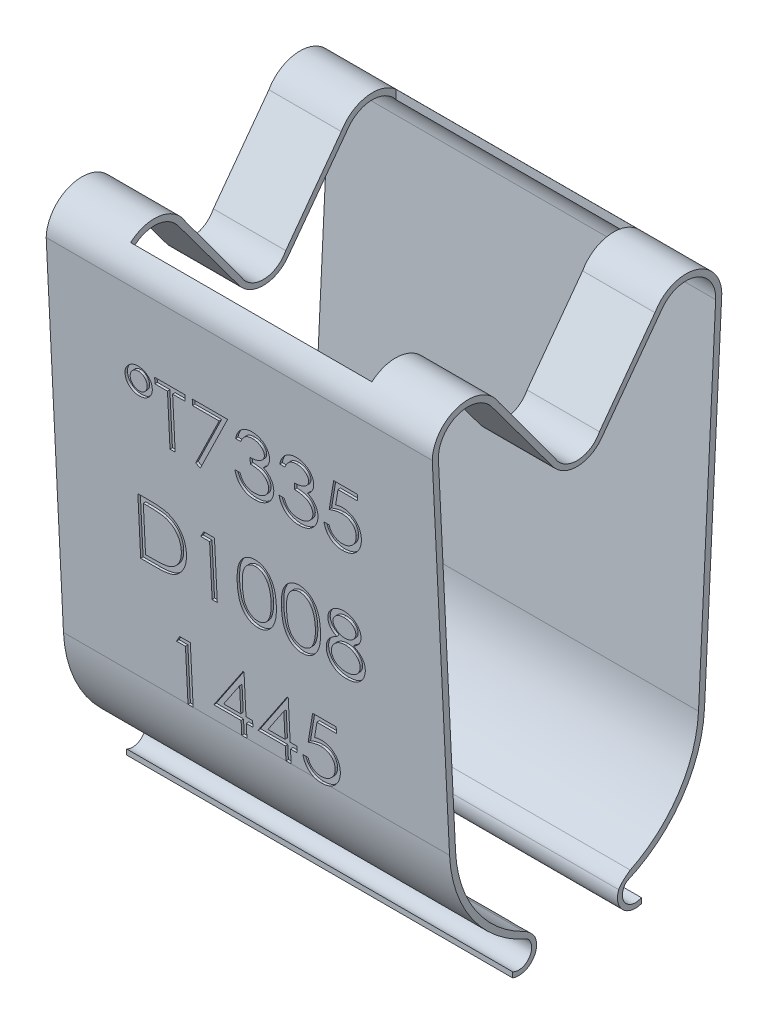
from build123d import *

# Parameters (mm, degrees)
BOSS_EXTRUDE1_DEPTH     = 16
CUT_EXTRUDE1_DEPTH      = 10
CUT_EXTRUDE1_DEPTH_BACK = 1
SKETCH2_W               = 11
SKETCH2_H               = 10
CUT_EXTRUDE3_DEPTH      = 0.1


with BuildPart() as part:
    # Sketch1 → Boss-Extrude1 (new body)
    with BuildSketch(Plane(origin=(0, 0, 0), x_dir=(0, 0, -1), z_dir=(1, 0, 0))):
        with BuildLine():
            Line((-5.283582943, -0.260482798), (-6, 14.271182927))
            ThreePointArc((-6, 14.271182927), (-4.875918032, 15.66720737), (-3.229257939, 14.959425587))
            Line((-3.229257939, 14.959425587), (-0.929772992, 11.836632288))
            ThreePointArc((-0.929772992, 11.836632288), (0, 11.263908985), (0.929772992, 11.836632288))
            Line((0.929772992, 11.836632288), (3.229257939, 14.959425587))
            ThreePointArc((3.229257939, 14.959425587), (4.875918032, 15.66720737), (6, 14.271182927))
            Line((6, 14.271182927), (5.283582943, -0.260482798))
            ThreePointArc((5.283582943, -0.260482798), (4.333406064, -3.034088312), (2.052160437, -4.875729437))
            ThreePointArc((2.052160437, -4.875729437), (1.976044115, -5.581216642), (2.664658389, -5.752436595))
            Line((2.664658389, -5.752436595), (2.664658389, -5.973090598))
            ThreePointArc((2.664658389, -5.973090598), (1.883497588, -5.787617011), (1.727121315, -5.000115195))
            add(Edge.make_bspline(
                [(1.727121315, -5.000115195), (1.783565653, -4.84446971), (2.037322884, -4.64724125), (2.204601947, -4.532254434)],
                knots=[0, 0, 0, 0, 1, 1, 1, 1], degree=3))
            ThreePointArc((2.204601947, -4.532254434), (4.205623245, -2.777468834), (5.033886206, -0.248172647))
            Line((5.033886206, -0.248172647), (5.744635961, 14.168538595))
            ThreePointArc((5.744635961, 14.168538595), (4.932293803, 15.384646047), (3.53277467, 14.960189555))
            Line((3.53277467, 14.960189555), (1.008642333, 11.556895611))
            ThreePointArc((1.008642333, 11.556895611), (0, 11.049197016), (-1.008642333, 11.556895611))
            Line((-1.008642333, 11.556895611), (-3.53277467, 14.960189555))
            ThreePointArc((-3.53277467, 14.960189555), (-4.932293803, 15.384646047), (-5.744635961, 14.168538595))
            Line((-5.744635961, 14.168538595), (-5.033886206, -0.248172647))
            ThreePointArc((-5.033886206, -0.248172647), (-4.205623245, -2.777468834), (-2.204601947, -4.532254434))
            add(Edge.make_bspline(
                [(-1.727121315, -5.000115195), (-1.784252323, -4.844720446), (-2.019574911, -4.615736461), (-2.204601947, -4.532254434)],
                knots=[0, 0, 0, 0, 1, 1, 1, 1], degree=3))
            ThreePointArc((-1.727121315, -5.000115195), (-1.883497588, -5.787617011), (-2.664658389, -5.973090598))
            Line((-2.664658389, -5.973090598), (-2.664658389, -5.752436595))
            ThreePointArc((-2.664658389, -5.752436595), (-1.976044115, -5.581216642), (-2.052160437, -4.875729437))
            ThreePointArc((-2.052160437, -4.875729437), (-4.333406064, -3.034088312), (-5.283582943, -0.260482798))
        make_face()
    extrude(amount=BOSS_EXTRUDE1_DEPTH)

    # Sketch2 → Cut-Extrude1 (cut, two sides: drawn at the far end of the back side and taken through both)
    with BuildSketch(Plane.ZX.offset(11.27158518).offset(-CUT_EXTRUDE1_DEPTH_BACK)):
        with Locations((0, 8)):
            Rectangle(SKETCH2_W, SKETCH2_H)
    extrude(amount=CUT_EXTRUDE1_DEPTH + CUT_EXTRUDE1_DEPTH_BACK, mode=Mode.SUBTRACT)

    # Sketch4 → Cut-Extrude3 (cut)
    # profile 1 of 15: a face of its own
    with BuildSketch(Plane(origin=(0, -0.260482798, 5.283582943), x_dir=(1, 0, 0), z_dir=(0, -0.049240604489838885, 0.9987869456843514))):
        with BuildLine():
            add(Edge.make_bspline(
                [(4.2296875, 11.145318349), (4.229339809, 11.12636166), (4.228655649, 11.089060158), (4.219933547, 11.034337298), (4.207358728, 10.981669767), (4.189116188, 10.931261977), (4.165487446, 10.88346591), (4.137350909, 10.837568832), (4.102942832, 10.794800955), (4.064831508, 10.753909422), (4.022548408, 10.717190542), (3.97816665, 10.68429139), (3.931002654, 10.657078509), (3.881877094, 10.634506341), (3.830337703, 10.617280608), (3.776668835, 10.604960504), (3.72079331, 10.597000547), (3.682739493, 10.596202945), (3.663472806, 10.595799118)],
                knots=[0, 0, 0, 0, 1.034311374, 2.035237678, 3.018835879, 3.988535298, 4.955586962, 5.926724039, 6.922210896, 7.948140028, 8.9758318, 9.976305946, 10.960823755, 11.944000181, 12.924372957, 13.922847624, 14.948335623, 16, 16, 16, 16], degree=3))
            add(Edge.make_bspline(
                [(3.663472806, 10.595799118), (3.644205014, 10.596199582), (3.606149012, 10.59699054), (3.550289422, 10.604998945), (3.496512065, 10.617152972), (3.445276463, 10.635004746), (3.396298532, 10.657636736), (3.349290643, 10.684806286), (3.3047381, 10.717494265), (3.263259702, 10.75493535), (3.225200855, 10.795746512), (3.191588053, 10.839200454), (3.163226509, 10.885232861), (3.140324017, 10.933793452), (3.121973783, 10.984525347), (3.109248685, 11.037640364), (3.101291056, 11.093081329), (3.100515922, 11.130821169), (3.100120192, 11.150088481)],
                knots=[0, 0, 0, 0, 1.048877944, 2.071648865, 3.067478027, 4.048049482, 5.020748126, 6.00265741, 7.000480754, 8.024717489, 9.042009667, 10.036368859, 11.012301115, 11.980826395, 12.956105095, 13.945510705, 14.951122056, 16, 16, 16, 16], degree=3))
            add(Edge.make_bspline(
                [(3.100120192, 11.150088481), (3.100737093, 11.168555359), (3.101949608, 11.204851928), (3.109571205, 11.258500624), (3.123162332, 11.309831997), (3.141002531, 11.359546707), (3.165592884, 11.406401967), (3.193867027, 11.452143586), (3.228776644, 11.494909227), (3.267530001, 11.5357607), (3.309963417, 11.573011606), (3.355009212, 11.6058561), (3.402509268, 11.633010043), (3.451838305, 11.655537825), (3.503044006, 11.673423411), (3.556332975, 11.685593503), (3.611548631, 11.693675739), (3.649132877, 11.694445956), (3.668242939, 11.69483758)],
                knots=[0, 0, 0, 0, 1.014023411, 1.9930587, 2.967060154, 3.925483522, 4.885932443, 5.866834192, 6.873010876, 7.910365301, 8.955806314, 9.968626493, 10.965901813, 11.95427271, 12.942643608, 13.937891749, 14.95150171, 16, 16, 16, 16], degree=3))
            add(Edge.make_bspline(
                [(3.668242939, 11.69483758), (3.687351737, 11.694441267), (3.724933496, 11.693661827), (3.780013693, 11.685668875), (3.833088866, 11.673305408), (3.883953829, 11.6557655), (3.932651663, 11.632861628), (3.979564758, 11.605842783), (4.024138561, 11.573161071), (4.065578222, 11.5355385), (4.104155315, 11.495063552), (4.137622944, 11.451504777), (4.165985859, 11.405770674), (4.189604282, 11.358155731), (4.207229419, 11.307921338), (4.220027911, 11.255689149), (4.228612946, 11.201251929), (4.229326416, 11.164113811), (4.2296875, 11.145318349)],
                knots=[0, 0, 0, 0, 1.048439503, 2.061992633, 3.048687608, 4.037003089, 5.009462214, 5.999126091, 7.004829708, 8.037155315, 9.068446971, 10.070659078, 11.046872281, 12.018978717, 12.982581913, 13.962845811, 14.969003949, 16, 16, 16, 16], degree=3))
        make_face()
        with BuildLine():
            add(Edge.make_bspline(
                [(4.015985577, 11.14245627), (4.01575859, 11.155350617), (4.015314164, 11.180597023), (4.010405942, 11.217667138), (4.002262191, 11.252910132), (3.991338652, 11.286714268), (3.976824394, 11.318698609), (3.959639009, 11.349484165), (3.939123116, 11.378674262), (3.915283702, 11.405517384), (3.889625591, 11.430263925), (3.862618108, 11.452406095), (3.833694753, 11.470648304), (3.803373595, 11.485386022), (3.772054507, 11.497595672), (3.738971906, 11.505455598), (3.70485086, 11.511118786), (3.681464632, 11.511481588), (3.669673978, 11.511664503)],
                knots=[0, 0, 0, 0, 1.096623922, 2.14712783, 3.174374369, 4.171236163, 5.164418809, 6.157877864, 7.167601745, 8.193421799, 9.207667531, 10.198636131, 11.159501563, 12.109446627, 13.064292557, 14.01259837, 14.998010094, 16, 16, 16, 16], degree=3))
            add(Edge.make_bspline(
                [(3.669673978, 11.511664503), (3.657739575, 11.511207104), (3.634097176, 11.510300983), (3.599281789, 11.505849764), (3.56606796, 11.496770571), (3.533740267, 11.485547478), (3.502776937, 11.470148662), (3.473246697, 11.451373596), (3.444612331, 11.429908984), (3.41858999, 11.404504056), (3.393459574, 11.3779549), (3.372842085, 11.348440601), (3.354163983, 11.318322769), (3.339630167, 11.2863383), (3.32791705, 11.253167308), (3.320014142, 11.218422795), (3.314373329, 11.182391408), (3.314006852, 11.157743194), (3.313822115, 11.145318349)],
                knots=[0, 0, 0, 0, 1.009905464, 2.000652069, 2.9594965, 3.916453441, 4.890637365, 5.875526928, 6.87327472, 7.910035599, 8.947493813, 9.958830498, 10.948116093, 11.94077701, 12.923093136, 13.917846453, 14.95041344, 16, 16, 16, 16], degree=3))
            add(Edge.make_bspline(
                [(3.313822115, 11.145318349), (3.313994688, 11.133050623), (3.314334805, 11.108872628), (3.320116327, 11.07333963), (3.327934098, 11.038913271), (3.339483646, 11.00581314), (3.354474941, 10.9740796), (3.372579768, 10.943497216), (3.394201845, 10.914296399), (3.418834653, 10.886867439), (3.445732171, 10.861889022), (3.473957748, 10.839834882), (3.503330335, 10.820800333), (3.534216943, 10.80583474), (3.566077849, 10.793616255), (3.599002939, 10.78496059), (3.633287325, 10.780276896), (3.656463523, 10.779411856), (3.668242939, 10.778972195)],
                knots=[0, 0, 0, 0, 1.040322373, 2.050331958, 3.049090637, 4.035362045, 5.01978373, 6.024637172, 7.048002391, 8.099650942, 9.150432584, 10.160442169, 11.137896218, 12.11600268, 13.068812255, 14.031517462, 14.999509185, 16, 16, 16, 16], degree=3))
            add(Edge.make_bspline(
                [(3.668242939, 10.778972195), (3.679875567, 10.779152221), (3.702947446, 10.779509281), (3.736736155, 10.785239202), (3.769672595, 10.793032432), (3.800979667, 10.80526348), (3.831341937, 10.819945814), (3.860131677, 10.838406349), (3.887852961, 10.859846064), (3.913852861, 10.884494542), (3.937518877, 10.911576492), (3.958639776, 10.940166253), (3.976591842, 10.970456432), (3.990476508, 11.002368366), (4.002450786, 11.035205118), (4.010351062, 11.06964207), (4.0153088, 11.105579574), (4.015757655, 11.130037077), (4.015985577, 11.14245627)],
                knots=[0, 0, 0, 0, 0.997068568, 1.977562118, 2.934115304, 3.897265488, 4.855472182, 5.824694218, 6.82651453, 7.859454664, 8.89419623, 9.909588333, 10.906656901, 11.908477213, 12.89257309, 13.902171052, 14.934750522, 16, 16, 16, 16], degree=3))
        make_face(mode=Mode.SUBTRACT)
    # profile 2 of 15: a face of its own
    with BuildSketch(Plane(origin=(0, -0.260482798, 5.283582943), x_dir=(1, 0, 0), z_dir=(0, -0.049240604489838885, 0.9987869456843514))):
        Polygon((4.351802885, 11.389549118), (4.351802885, 11.633779887), (5.603485577, 11.633779887), (5.603485577, 11.389549118), (5.084495192, 11.389549118), (5.084495192, 9.252529887), (4.870793269, 9.252529887), (4.870793269, 11.389549118), align=None)
    # profile 3 of 15: a face of its own
    with BuildSketch(Plane(origin=(0, -0.260482798, 5.283582943), x_dir=(1, 0, 0), z_dir=(0, -0.049240604489838885, 0.9987869456843514))):
        Polygon((5.908774038, 11.633779887), (7.374158654, 11.633779887), (6.122475962, 9.191472195), (5.937871845, 9.293076011), (7.012582632, 11.389549118), (5.908774038, 11.389549118), align=None)
    # profile 4 of 15: a face of its own
    with BuildSketch(Plane(origin=(0, -0.260482798, 5.283582943), x_dir=(1, 0, 0), z_dir=(0, -0.049240604489838885, 0.9987869456843514))):
        with BuildLine():
            Line((7.893149038, 11.084260657), (7.679447115, 11.084260657))
            add(Edge.make_bspline(
                [(7.679447115, 11.084260657), (7.685236649, 11.108231329), (7.696554714, 11.155092032), (7.720161456, 11.222044115), (7.745878449, 11.285401368), (7.77675925, 11.343977447), (7.810442885, 11.398949557), (7.849034594, 11.449070872), (7.890753905, 11.495616122), (7.936899094, 11.536922807), (7.985291987, 11.574327298), (8.036614469, 11.606219078), (8.089833973, 11.633653903), (8.14531923, 11.656255525), (8.203235429, 11.673281819), (8.263058976, 11.685634931), (8.324946643, 11.6936571), (8.366957058, 11.69444003), (8.388288762, 11.69483758)],
                knots=[0, 0, 0, 0, 1.162005537, 2.271625781, 3.343758855, 4.383309926, 5.390229558, 6.379919256, 7.361854164, 8.333198761, 9.295911338, 10.242430842, 11.177959212, 12.116337295, 13.062827104, 14.020064771, 14.994644689, 16, 16, 16, 16], degree=3))
            add(Edge.make_bspline(
                [(8.388288762, 11.69483758), (8.419369342, 11.693899211), (8.480852544, 11.692042941), (8.571178831, 11.675092226), (8.658282792, 11.648269056), (8.741211013, 11.611207466), (8.818239982, 11.565496098), (8.886776566, 11.511091518), (8.945891785, 11.449043422), (8.995485996, 11.380509302), (9.034317379, 11.307265107), (9.062951144, 11.231881429), (9.080383037, 11.154537088), (9.082642202, 11.102314725), (9.083774038, 11.076151432)],
                knots=[0, 0, 0, 0, 1.083050992, 2.142477498, 3.193116406, 4.255571735, 5.30263384, 6.308962982, 7.297363603, 8.282367274, 9.249857812, 10.179914175, 11.08814088, 12, 12, 12, 12], degree=3))
            add(Edge.make_bspline(
                [(9.083774038, 11.076151432), (9.082982381, 11.050973595), (9.08143323, 11.001704475), (9.068279405, 10.929776099), (9.046143127, 10.861984225), (9.015479592, 10.79804347), (8.975786501, 10.738359248), (8.927703827, 10.682797276), (8.870892195, 10.631111117), (8.827839917, 10.601502332), (8.805675331, 10.586258854)],
                knots=[0, 0, 0, 0, 1.024540389, 2.004866551, 2.965041327, 3.920577974, 4.882998113, 5.874504559, 6.905732034, 8, 8, 8, 8], degree=3))
            add(Edge.make_bspline(
                [(8.805675331, 10.586258854), (8.831006221, 10.574027276), (8.881194041, 10.549792984), (8.949604311, 10.50226612), (9.011705866, 10.447390998), (9.046338575, 10.404567515), (9.063739483, 10.383051222)],
                knots=[0, 0, 0, 0, 1.015518401, 2.012035669, 3.001164323, 4, 4, 4, 4], degree=3))
            add(Edge.make_bspline(
                [(9.063739483, 10.383051222), (9.075197611, 10.367363716), (9.097926231, 10.336245597), (9.125981121, 10.286214565), (9.151432679, 10.235628998), (9.171265239, 10.183133045), (9.186623531, 10.129335155), (9.197601795, 10.074142954), (9.204421791, 10.01751137), (9.205398479, 9.979198772), (9.205889423, 9.959940494)],
                knots=[0, 0, 0, 0, 1.025084078, 2.033381695, 3.024893161, 4.013698104, 4.991890475, 5.976764909, 6.982997093, 8, 8, 8, 8], degree=3))
            add(Edge.make_bspline(
                [(9.205889423, 9.959940494), (9.204668513, 9.926596381), (9.202232438, 9.860065071), (9.180458238, 9.761770662), (9.146703515, 9.665686883), (9.098767636, 9.573787751), (9.040347063, 9.487803956), (8.970843597, 9.410871681), (8.891046952, 9.344741917), (8.802052394, 9.289489958), (8.705634133, 9.245322586), (8.602508597, 9.214667433), (8.494161685, 9.194701672), (8.41986172, 9.192560678), (8.38208759, 9.191472195)],
                knots=[0, 0, 0, 0, 0.955779014, 1.907060117, 2.875433937, 3.871313158, 4.872415639, 5.851225146, 6.836215519, 7.83643374, 8.849228613, 9.86973379, 10.916971861, 12, 12, 12, 12], degree=3))
            add(Edge.make_bspline(
                [(8.38208759, 9.191472195), (8.356629102, 9.19206289), (8.306535287, 9.193225181), (8.232891049, 9.201170801), (8.162595393, 9.215682822), (8.095553274, 9.235211321), (8.031705133, 9.259970703), (7.971245804, 9.290803603), (7.913803323, 9.327074464), (7.859919751, 9.369211423), (7.809601511, 9.416347477), (7.764185818, 9.469319411), (7.722915495, 9.527148002), (7.686895593, 9.590504938), (7.654485452, 9.658571443), (7.627828408, 9.732219083), (7.604365905, 9.810789462), (7.593457423, 9.865543067), (7.587860577, 9.893635657)],
                knots=[0, 0, 0, 0, 1.048658725, 2.063410685, 3.046034179, 4.001477787, 4.936774919, 5.862367409, 6.792675028, 7.730719943, 8.675894397, 9.627829632, 10.600096036, 11.597688215, 12.626045268, 13.701542398, 14.82072376, 16, 16, 16, 16], degree=3))
            Line((7.587860577, 9.893635657), (7.8015625, 9.893635657))
            add(Edge.make_bspline(
                [(7.8015625, 9.893635657), (7.807130061, 9.875300703), (7.81795945, 9.839637626), (7.836393249, 9.788311275), (7.857394699, 9.741259099), (7.879924425, 9.698135939), (7.903586189, 9.658517108), (7.930062237, 9.62345023), (7.957391601, 9.591395065), (7.977992376, 9.573335249), (7.988074669, 9.564496534)],
                knots=[0, 0, 0, 0, 1.198163088, 2.33053128, 3.407730985, 4.417276592, 5.372219308, 6.28897303, 7.162600585, 8, 8, 8, 8], degree=3))
            add(Edge.make_bspline(
                [(7.988074669, 9.564496534), (8.00140734, 9.554217471), (8.028031527, 9.533691075), (8.071416699, 9.507496217), (8.117044773, 9.484798805), (8.165904399, 9.46746079), (8.216941234, 9.452780275), (8.27098021, 9.443173279), (8.32754457, 9.436581862), (8.366166923, 9.436000203), (8.385903696, 9.435702964)],
                knots=[0, 0, 0, 0, 0.946170439, 1.889420265, 2.845303464, 3.807233317, 4.801018734, 5.828864929, 6.890507805, 8, 8, 8, 8], degree=3))
            add(Edge.make_bspline(
                [(8.385903696, 9.435702964), (8.408187775, 9.436122), (8.451762369, 9.436941388), (8.51534505, 9.444476824), (8.575833867, 9.455451266), (8.632557233, 9.472400992), (8.686258167, 9.493342964), (8.736183897, 9.519637683), (8.782989819, 9.550488288), (8.826076432, 9.585553323), (8.864819715, 9.62394009), (8.898932491, 9.664090054), (8.927932484, 9.705833931), (8.951325597, 9.749402724), (8.969797668, 9.794616014), (8.982372845, 9.841600682), (8.991116465, 9.889972214), (8.991828536, 9.922853174), (8.9921875, 9.939428926)],
                knots=[0, 0, 0, 0, 1.217147791, 2.380027433, 3.494444702, 4.572153297, 5.609568379, 6.639424714, 7.649109417, 8.668170816, 9.669597737, 10.625200337, 11.543417969, 12.441394052, 13.322311151, 14.205496177, 15.095365482, 16, 16, 16, 16], degree=3))
            add(Edge.make_bspline(
                [(8.9921875, 9.939428926), (8.991146348, 9.961616283), (8.989069226, 10.005880597), (8.973211067, 10.071002732), (8.947126947, 10.133747589), (8.910610471, 10.193044654), (8.866158841, 10.248001115), (8.814203431, 10.297035463), (8.754312797, 10.337496365), (8.699190351, 10.365451325), (8.650364414, 10.38452655), (8.608580018, 10.397232195), (8.561800972, 10.407991129), (8.510592974, 10.418000728), (8.454570179, 10.426519716), (8.393793577, 10.43362388), (8.328250854, 10.439308292), (8.282877043, 10.441846769), (8.259495192, 10.443154887)],
                knots=[0, 0, 0, 0, 1.07054697, 2.135767047, 3.216561865, 4.33974944, 5.486079747, 6.621378074, 7.775625952, 8.963672916, 9.598146892, 10.304877434, 11.070270905, 11.915000392, 12.823868403, 13.805723172, 14.86925407, 16, 16, 16, 16], degree=3))
            Line((8.259495192, 10.443154887), (8.259495192, 10.687385657))
            add(Edge.make_bspline(
                [(8.259495192, 10.687385657), (8.28895545, 10.687885586), (8.346660857, 10.688864824), (8.430953232, 10.700708488), (8.511557396, 10.717091915), (8.586687019, 10.742187019), (8.65516409, 10.771333721), (8.714572605, 10.805251028), (8.764080253, 10.842952848), (8.803446447, 10.885021106), (8.833061868, 10.930139022), (8.854715457, 10.977163034), (8.867506394, 11.026505297), (8.869213863, 11.060179348), (8.870072115, 11.077105458)],
                knots=[0, 0, 0, 0, 1.321986639, 2.589447074, 3.816329219, 5.01088745, 6.139805852, 7.153945165, 8.075214402, 8.924034688, 9.728124013, 10.488707548, 11.240355623, 12, 12, 12, 12], degree=3))
            add(Edge.make_bspline(
                [(8.870072115, 11.077105458), (8.869790168, 11.089540853), (8.869229247, 11.11428048), (8.862155385, 11.1504245), (8.851525457, 11.185463537), (8.836911569, 11.219248583), (8.817351166, 11.251545323), (8.793942808, 11.282629105), (8.766069868, 11.312322462), (8.734130198, 11.339999608), (8.699832166, 11.366376535), (8.662242587, 11.388769563), (8.622494847, 11.407918257), (8.580544941, 11.423709008), (8.536256732, 11.435587559), (8.489838306, 11.444116408), (8.44120115, 11.449448813), (8.408018954, 11.450216538), (8.391150841, 11.450606811)],
                knots=[0, 0, 0, 0, 0.884392785, 1.759457502, 2.611959086, 3.489218968, 4.37281399, 5.2945488, 6.255912374, 7.266815255, 8.301784654, 9.332968512, 10.37626691, 11.440494194, 12.520033166, 13.637162961, 14.798855837, 16, 16, 16, 16], degree=3))
            add(Edge.make_bspline(
                [(8.391150841, 11.450606811), (8.364037474, 11.449660187), (8.311078763, 11.447811212), (8.234732542, 11.431616662), (8.163758138, 11.405778002), (8.109507367, 11.374935358), (8.069446187, 11.344489081), (8.040818842, 11.3178991), (8.012706137, 11.288349268), (7.986957561, 11.254019552), (7.960917587, 11.217234825), (7.937210841, 11.176125142), (7.914174157, 11.131762867), (7.900293137, 11.100401372), (7.893149038, 11.084260657)],
                knots=[0, 0, 0, 0, 1.472543308, 2.876219568, 4.221790263, 5.565193594, 6.249813518, 6.953379497, 7.687249741, 8.463570142, 9.283606569, 10.136032583, 11.040678096, 12, 12, 12, 12], degree=3))
        make_face()
    # profile 5 of 15: a face of its own
    with BuildSketch(Plane(origin=(0, -0.260482798, 5.283582943), x_dir=(1, 0, 0), z_dir=(0, -0.049240604489838885, 0.9987869456843514))):
        with BuildLine():
            Line((9.724879808, 11.084260657), (9.511177885, 11.084260657))
            add(Edge.make_bspline(
                [(9.511177885, 11.084260657), (9.516967418, 11.108231329), (9.528285483, 11.155092032), (9.551892225, 11.222044115), (9.577609218, 11.285401368), (9.60849002, 11.343977447), (9.642173654, 11.398949557), (9.680765363, 11.449070872), (9.722484674, 11.495616122), (9.768629863, 11.536922807), (9.817022756, 11.574327298), (9.868345238, 11.606219078), (9.921564743, 11.633653903), (9.977049999, 11.656255525), (10.034966198, 11.673281819), (10.094789745, 11.685634931), (10.156677412, 11.6936571), (10.198687827, 11.69444003), (10.220019531, 11.69483758)],
                knots=[0, 0, 0, 0, 1.162005537, 2.271625781, 3.343758855, 4.383309926, 5.390229558, 6.379919256, 7.361854164, 8.333198761, 9.295911338, 10.242430842, 11.177959212, 12.116337295, 13.062827104, 14.020064771, 14.994644689, 16, 16, 16, 16], degree=3))
            add(Edge.make_bspline(
                [(10.220019531, 11.69483758), (10.251100111, 11.693899211), (10.312583313, 11.692042941), (10.402909601, 11.675092226), (10.490013561, 11.648269056), (10.572941782, 11.611207466), (10.649970751, 11.565496098), (10.718507335, 11.511091518), (10.777622554, 11.449043422), (10.827216765, 11.380509302), (10.866048148, 11.307265107), (10.894681913, 11.231881429), (10.912113807, 11.154537088), (10.914372971, 11.102314725), (10.915504808, 11.076151432)],
                knots=[0, 0, 0, 0, 1.083050992, 2.142477498, 3.193116406, 4.255571735, 5.30263384, 6.308962982, 7.297363603, 8.282367274, 9.249857812, 10.179914175, 11.08814088, 12, 12, 12, 12], degree=3))
            add(Edge.make_bspline(
                [(10.915504808, 11.076151432), (10.91471315, 11.050973595), (10.913163999, 11.001704475), (10.900010175, 10.929776099), (10.877873896, 10.861984225), (10.847210361, 10.79804347), (10.807517271, 10.738359248), (10.759434596, 10.682797276), (10.702622964, 10.631111117), (10.659570687, 10.601502332), (10.6374061, 10.586258854)],
                knots=[0, 0, 0, 0, 1.024540389, 2.004866551, 2.965041327, 3.920577974, 4.882998113, 5.874504559, 6.905732034, 8, 8, 8, 8], degree=3))
            add(Edge.make_bspline(
                [(10.6374061, 10.586258854), (10.66273699, 10.574027276), (10.71292481, 10.549792984), (10.781335081, 10.50226612), (10.843436635, 10.447390998), (10.878069344, 10.404567515), (10.895470252, 10.383051222)],
                knots=[0, 0, 0, 0, 1.015518401, 2.012035669, 3.001164323, 4, 4, 4, 4], degree=3))
            add(Edge.make_bspline(
                [(10.895470252, 10.383051222), (10.90692838, 10.367363716), (10.929657, 10.336245597), (10.95771189, 10.286214565), (10.983163448, 10.235628998), (11.002996008, 10.183133045), (11.0183543, 10.129335155), (11.029332565, 10.074142954), (11.036152561, 10.01751137), (11.037129249, 9.979198772), (11.037620192, 9.959940494)],
                knots=[0, 0, 0, 0, 1.025084078, 2.033381695, 3.024893161, 4.013698104, 4.991890475, 5.976764909, 6.982997093, 8, 8, 8, 8], degree=3))
            add(Edge.make_bspline(
                [(11.037620192, 9.959940494), (11.036399282, 9.926596381), (11.033963208, 9.860065071), (11.012189007, 9.761770662), (10.978434284, 9.665686883), (10.930498405, 9.573787751), (10.872077832, 9.487803956), (10.802574367, 9.410871681), (10.722777721, 9.344741917), (10.633783163, 9.289489958), (10.537364903, 9.245322586), (10.434239366, 9.214667433), (10.325892454, 9.194701672), (10.251592489, 9.192560678), (10.213818359, 9.191472195)],
                knots=[0, 0, 0, 0, 0.955779014, 1.907060117, 2.875433937, 3.871313158, 4.872415639, 5.851225146, 6.836215519, 7.83643374, 8.849228613, 9.86973379, 10.916971861, 12, 12, 12, 12], degree=3))
            add(Edge.make_bspline(
                [(10.213818359, 9.191472195), (10.188359871, 9.19206289), (10.138266056, 9.193225181), (10.064621818, 9.201170801), (9.994326162, 9.215682822), (9.927284043, 9.235211321), (9.863435902, 9.259970703), (9.802976573, 9.290803603), (9.745534092, 9.327074464), (9.69165052, 9.369211423), (9.64133228, 9.416347477), (9.595916588, 9.469319411), (9.554646264, 9.527148002), (9.518626362, 9.590504938), (9.486216221, 9.658571443), (9.459559177, 9.732219083), (9.436096674, 9.810789462), (9.425188192, 9.865543067), (9.419591346, 9.893635657)],
                knots=[0, 0, 0, 0, 1.048658725, 2.063410685, 3.046034179, 4.001477787, 4.936774919, 5.862367409, 6.792675028, 7.730719943, 8.675894397, 9.627829632, 10.600096036, 11.597688215, 12.626045268, 13.701542398, 14.82072376, 16, 16, 16, 16], degree=3))
            Line((9.419591346, 9.893635657), (9.633293269, 9.893635657))
            add(Edge.make_bspline(
                [(9.633293269, 9.893635657), (9.63886083, 9.875300703), (9.649690219, 9.839637626), (9.668124019, 9.788311275), (9.689125468, 9.741259099), (9.711655194, 9.698135939), (9.735316959, 9.658517108), (9.761793006, 9.62345023), (9.789122371, 9.591395065), (9.809723145, 9.573335249), (9.819805439, 9.564496534)],
                knots=[0, 0, 0, 0, 1.198163088, 2.33053128, 3.407730985, 4.417276592, 5.372219308, 6.28897303, 7.162600585, 8, 8, 8, 8], degree=3))
            add(Edge.make_bspline(
                [(9.819805439, 9.564496534), (9.83313811, 9.554217471), (9.859762296, 9.533691075), (9.903147468, 9.507496217), (9.948775542, 9.484798805), (9.997635169, 9.46746079), (10.048672003, 9.452780275), (10.102710979, 9.443173279), (10.159275339, 9.436581862), (10.197897692, 9.436000203), (10.217634465, 9.435702964)],
                knots=[0, 0, 0, 0, 0.946170439, 1.889420265, 2.845303464, 3.807233317, 4.801018734, 5.828864929, 6.890507805, 8, 8, 8, 8], degree=3))
            add(Edge.make_bspline(
                [(10.217634465, 9.435702964), (10.239918545, 9.436122), (10.283493138, 9.436941388), (10.347075819, 9.444476824), (10.407564636, 9.455451266), (10.464288002, 9.472400992), (10.517988936, 9.493342964), (10.567914666, 9.519637683), (10.614720588, 9.550488288), (10.657807202, 9.585553323), (10.696550484, 9.62394009), (10.73066326, 9.664090054), (10.759663253, 9.705833931), (10.783056366, 9.749402724), (10.801528437, 9.794616014), (10.814103615, 9.841600682), (10.822847235, 9.889972214), (10.823559305, 9.922853174), (10.823918269, 9.939428926)],
                knots=[0, 0, 0, 0, 1.217147791, 2.380027433, 3.494444702, 4.572153297, 5.609568379, 6.639424714, 7.649109417, 8.668170816, 9.669597737, 10.625200337, 11.543417969, 12.441394052, 13.322311151, 14.205496177, 15.095365482, 16, 16, 16, 16], degree=3))
            add(Edge.make_bspline(
                [(10.823918269, 9.939428926), (10.822877118, 9.961616283), (10.820799995, 10.005880597), (10.804941837, 10.071002732), (10.778857717, 10.133747589), (10.74234124, 10.193044654), (10.69788961, 10.248001115), (10.645934201, 10.297035463), (10.586043567, 10.337496365), (10.53092112, 10.365451325), (10.482095183, 10.38452655), (10.440310788, 10.397232195), (10.393531741, 10.407991129), (10.342323743, 10.418000728), (10.286300948, 10.426519716), (10.225524346, 10.43362388), (10.159981623, 10.439308292), (10.114607812, 10.441846769), (10.091225962, 10.443154887)],
                knots=[0, 0, 0, 0, 1.07054697, 2.135767047, 3.216561865, 4.33974944, 5.486079747, 6.621378074, 7.775625952, 8.963672916, 9.598146892, 10.304877434, 11.070270905, 11.915000392, 12.823868403, 13.805723172, 14.86925407, 16, 16, 16, 16], degree=3))
            Line((10.091225962, 10.443154887), (10.091225962, 10.687385657))
            add(Edge.make_bspline(
                [(10.091225962, 10.687385657), (10.120686219, 10.687885586), (10.178391626, 10.688864824), (10.262684001, 10.700708488), (10.343288165, 10.717091915), (10.418417788, 10.742187019), (10.486894859, 10.771333721), (10.546303374, 10.805251028), (10.595811023, 10.842952848), (10.635177216, 10.885021106), (10.664792638, 10.930139022), (10.686446227, 10.977163034), (10.699237163, 11.026505297), (10.700944633, 11.060179348), (10.701802885, 11.077105458)],
                knots=[0, 0, 0, 0, 1.321986639, 2.589447074, 3.816329219, 5.01088745, 6.139805852, 7.153945165, 8.075214402, 8.924034688, 9.728124013, 10.488707548, 11.240355623, 12, 12, 12, 12], degree=3))
            add(Edge.make_bspline(
                [(10.701802885, 11.077105458), (10.701520937, 11.089540853), (10.700960016, 11.11428048), (10.693886154, 11.1504245), (10.683256226, 11.185463537), (10.668642339, 11.219248583), (10.649081936, 11.251545323), (10.625673577, 11.282629105), (10.597800637, 11.312322462), (10.565860967, 11.339999608), (10.531562936, 11.366376535), (10.493973356, 11.388769563), (10.454225617, 11.407918257), (10.41227571, 11.423709008), (10.367987501, 11.435587559), (10.321569076, 11.444116408), (10.272931919, 11.449448813), (10.239749723, 11.450216538), (10.222881611, 11.450606811)],
                knots=[0, 0, 0, 0, 0.884392785, 1.759457502, 2.611959086, 3.489218968, 4.37281399, 5.2945488, 6.255912374, 7.266815255, 8.301784654, 9.332968512, 10.37626691, 11.440494194, 12.520033166, 13.637162961, 14.798855837, 16, 16, 16, 16], degree=3))
            add(Edge.make_bspline(
                [(10.222881611, 11.450606811), (10.195768244, 11.449660187), (10.142809532, 11.447811212), (10.066463312, 11.431616662), (9.995488908, 11.405778002), (9.941238136, 11.374935358), (9.901176956, 11.344489081), (9.872549611, 11.3178991), (9.844436906, 11.288349268), (9.81868833, 11.254019552), (9.792648356, 11.217234825), (9.76894161, 11.176125142), (9.745904927, 11.131762867), (9.732023906, 11.100401372), (9.724879808, 11.084260657)],
                knots=[0, 0, 0, 0, 1.472543308, 2.876219568, 4.221790263, 5.565193594, 6.249813518, 6.953379497, 7.687249741, 8.463570142, 9.283606569, 10.136032583, 11.040678096, 12, 12, 12, 12], degree=3))
        make_face()
    # profile 6 of 15: a face of its own
    with BuildSketch(Plane(origin=(0, -0.260482798, 5.283582943), x_dir=(1, 0, 0), z_dir=(0, -0.049240604489838885, 0.9987869456843514))):
        with BuildLine():
            Line((12.747235577, 11.633779887), (12.747235577, 11.389549118))
            Line((12.747235577, 11.389549118), (11.937267127, 11.389549118))
            Line((11.937267127, 11.389549118), (11.808950571, 10.763230759))
            add(Edge.make_bspline(
                [(11.808950571, 10.763230759), (11.8341618, 10.770190997), (11.883004568, 10.783675359), (11.955095116, 10.798647142), (12.023533741, 10.807672381), (12.067944305, 10.808904719), (12.089434345, 10.809501041)],
                knots=[0, 0, 0, 0, 1.100273476, 2.13160584, 3.095893838, 4, 4, 4, 4], degree=3))
            add(Edge.make_bspline(
                [(12.089434345, 10.809501041), (12.116025246, 10.808925503), (12.168309602, 10.807793851), (12.244808243, 10.796927289), (12.317832944, 10.779823168), (12.387230985, 10.75592867), (12.453130752, 10.725374013), (12.514925933, 10.687206018), (12.573544084, 10.642619948), (12.627933599, 10.591358431), (12.67727603, 10.534942116), (12.720659677, 10.474282922), (12.757509582, 10.409970352), (12.787146452, 10.341389938), (12.810812223, 10.269299871), (12.826563848, 10.192941632), (12.837052716, 10.113034964), (12.838224554, 10.058399176), (12.838822115, 10.030538451)],
                knots=[0, 0, 0, 0, 1.052922333, 2.070308379, 3.05430497, 4.020497103, 4.973039431, 5.925935799, 6.892292201, 7.88610001, 8.88166317, 9.857072816, 10.836096531, 11.812156883, 12.81219415, 13.836441305, 14.89672472, 16, 16, 16, 16], degree=3))
            add(Edge.make_bspline(
                [(12.838822115, 10.030538451), (12.838369627, 10.011133155), (12.837470764, 9.972584808), (12.832899725, 9.9153367), (12.824098818, 9.859300558), (12.812282563, 9.804468949), (12.796945668, 9.750945679), (12.778379365, 9.698577551), (12.755658139, 9.647690506), (12.730735722, 9.597803049), (12.702673386, 9.550042994), (12.671527651, 9.505378237), (12.638621844, 9.463138752), (12.603215116, 9.423777552), (12.564978367, 9.387553284), (12.524374675, 9.354250971), (12.48172804, 9.323307423), (12.436378669, 9.295978705), (12.389337087, 9.270830694), (12.339923961, 9.250199858), (12.289264092, 9.231755017), (12.236628346, 9.217052821), (12.182135948, 9.205532636), (12.125697074, 9.19770812), (12.067607726, 9.192009151), (12.028232047, 9.191652401), (12.008342097, 9.191472195)],
                knots=[0, 0, 0, 0, 1.056347294, 2.098418968, 3.122841568, 4.141288669, 5.149314143, 6.15115421, 7.162517403, 8.180376062, 9.185164535, 10.17417709, 11.141909838, 12.097768115, 13.052685741, 14.0056014, 14.954263652, 15.917497458, 16.885230207, 17.854509472, 18.828990115, 19.81800267, 20.826176721, 21.857883937, 22.917946725, 24, 24, 24, 24], degree=3))
            add(Edge.make_bspline(
                [(12.008342097, 9.191472195), (11.984615199, 9.191942212), (11.937935331, 9.192866914), (11.869545445, 9.202540562), (11.803744972, 9.216395298), (11.7410636, 9.237238903), (11.680939579, 9.263355973), (11.624182337, 9.296364297), (11.569341622, 9.333769723), (11.518646825, 9.377911534), (11.47159597, 9.426159525), (11.429477434, 9.478518206), (11.391966911, 9.534123416), (11.359665087, 9.593245195), (11.332111969, 9.655728196), (11.310466414, 9.721806523), (11.292995962, 9.791134919), (11.285604957, 9.838864361), (11.281850962, 9.863106811)],
                knots=[0, 0, 0, 0, 1.0467383, 2.05933395, 3.04377827, 4.011590433, 4.970194871, 5.932262533, 6.905835911, 7.896367577, 8.894135286, 9.877477877, 10.858688626, 11.851381753, 12.8477658, 13.868841284, 14.917554742, 16, 16, 16, 16], degree=3))
            Line((11.281850962, 9.863106811), (11.495552885, 9.863106811))
            add(Edge.make_bspline(
                [(11.495552885, 9.863106811), (11.500811064, 9.840398903), (11.510917576, 9.796753043), (11.53310113, 9.735431541), (11.560224163, 9.680785784), (11.592476051, 9.632092906), (11.630950268, 9.589632499), (11.674853326, 9.551793034), (11.724075616, 9.517656026), (11.778771724, 9.489201608), (11.836474908, 9.464934117), (11.896868313, 9.448774481), (11.958307521, 9.43741191), (11.999862626, 9.436274515), (12.020744441, 9.435702964)],
                knots=[0, 0, 0, 0, 1.136247022, 2.183929868, 3.172523383, 4.106158343, 5.02341133, 5.958108904, 6.928429099, 7.938127109, 8.96079061, 9.975095812, 10.982467395, 12, 12, 12, 12], degree=3))
            add(Edge.make_bspline(
                [(12.020744441, 9.435702964), (12.041126883, 9.436261386), (12.081260077, 9.437360924), (12.140322824, 9.445823895), (12.197345512, 9.458857885), (12.251765481, 9.478363626), (12.304535029, 9.502070479), (12.354319326, 9.5324927), (12.402558605, 9.567503891), (12.44775346, 9.607615456), (12.489146014, 9.651818052), (12.525719375, 9.699087492), (12.556183668, 9.749513418), (12.581856338, 9.802222831), (12.601350815, 9.857793421), (12.615257983, 9.915964756), (12.623424349, 9.97688052), (12.624547741, 10.018429461), (12.625120192, 10.039601702)],
                knots=[0, 0, 0, 0, 1.027316725, 2.022795036, 3.002884548, 3.971462791, 4.93288096, 5.914575861, 6.907176829, 7.935150275, 8.956128384, 9.956726525, 10.942570165, 11.921478529, 12.907843606, 13.90538589, 14.932640048, 16, 16, 16, 16], degree=3))
            add(Edge.make_bspline(
                [(12.625120192, 10.039601702), (12.624672191, 10.058703241), (12.623795292, 10.096091784), (12.616630744, 10.150791958), (12.604168661, 10.202548796), (12.586871342, 10.25161223), (12.564909749, 10.298028536), (12.538072168, 10.341845618), (12.505854946, 10.382485958), (12.469053143, 10.419968571), (12.428736512, 10.454561244), (12.384211394, 10.484050703), (12.336409551, 10.50885919), (12.285906913, 10.530268668), (12.231502223, 10.545645246), (12.174272871, 10.557189468), (12.113600861, 10.56386742), (12.072119018, 10.564793991), (12.050796274, 10.565270272)],
                knots=[0, 0, 0, 0, 1.045622112, 2.046656509, 3.013763289, 3.955457236, 4.890082067, 5.820317437, 6.762574623, 7.722996705, 8.69280354, 9.665887285, 10.63943826, 11.638615906, 12.663482002, 13.728887084, 14.832589034, 16, 16, 16, 16], degree=3))
            add(Edge.make_bspline(
                [(12.050796274, 10.565270272), (12.032338914, 10.564875263), (11.994229147, 10.564059669), (11.935770938, 10.558054498), (11.874340319, 10.548366693), (11.810172779, 10.535041049), (11.743075611, 10.517602763), (11.673190414, 10.496705933), (11.600370247, 10.471721859), (11.551304438, 10.45285405), (11.526081731, 10.443154887)],
                knots=[0, 0, 0, 0, 0.817624296, 1.688186739, 2.600797293, 3.572016777, 4.590301741, 5.671205678, 6.80286297, 8, 8, 8, 8], degree=3))
            Line((11.526081731, 10.443154887), (11.7703125, 11.633779887))
            Line((11.7703125, 11.633779887), (12.747235577, 11.633779887))
        make_face()
    # profile 7 of 15: a face of its own
    with BuildSketch(Plane(origin=(0, -0.260482798, 5.283582943), x_dir=(1, 0, 0), z_dir=(0, -0.049240604489838885, 0.9987869456843514))):
        with BuildLine():
            add(Edge.make_bspline(
                [(12.302182242, 5.812460444), (12.321673485, 5.802297299), (12.35968792, 5.782475772), (12.413828842, 5.750559656), (12.463307816, 5.716922142), (12.509497645, 5.683152031), (12.551586817, 5.647956032), (12.589104712, 5.611194188), (12.622978075, 5.573784108), (12.652523798, 5.535092306), (12.678511289, 5.495221575), (12.700971331, 5.454067266), (12.720169106, 5.411719569), (12.735383891, 5.367716226), (12.747917289, 5.322703619), (12.756541227, 5.276100528), (12.761179166, 5.228214039), (12.762056019, 5.195850605), (12.7625, 5.1794639)],
                knots=[0, 0, 0, 0, 1.272397273, 2.481599622, 3.635517121, 4.734568067, 5.792894095, 6.808321871, 7.773003508, 8.711915296, 9.623354172, 10.525449501, 11.423591555, 12.311487226, 13.218079475, 14.126165749, 15.051214107, 16, 16, 16, 16], degree=3))
            add(Edge.make_bspline(
                [(12.7625, 5.1794639), (12.761975159, 5.156537407), (12.7609363, 5.111157275), (12.751887561, 5.04417876), (12.738339624, 4.979128601), (12.71855517, 4.91602106), (12.692896595, 4.855204361), (12.661275748, 4.796626446), (12.625481339, 4.739327237), (12.596734726, 4.704071537), (12.582189002, 4.686232229)],
                knots=[0, 0, 0, 0, 1.025265484, 2.029385089, 3.018602448, 3.995076438, 4.983346944, 5.966715145, 6.97116228, 8, 8, 8, 8], degree=3))
            add(Edge.make_bspline(
                [(12.582189002, 4.686232229), (12.563250258, 4.665417537), (12.525606801, 4.624045364), (12.46112056, 4.570330616), (12.390348528, 4.525189332), (12.313564555, 4.488401132), (12.230973891, 4.459767718), (12.142594135, 4.439192005), (12.048252988, 4.427406566), (11.98341123, 4.425702959), (11.950146484, 4.424828984)],
                knots=[0, 0, 0, 0, 0.954267603, 1.896743057, 2.838368354, 3.796610408, 4.779680527, 5.799409237, 6.871065594, 8, 8, 8, 8], degree=3))
            add(Edge.make_bspline(
                [(11.950146484, 4.424828984), (11.91816059, 4.425613081), (11.855919287, 4.427138853), (11.765324374, 4.437476493), (11.680876357, 4.455592952), (11.602084218, 4.480388303), (11.529422964, 4.51264419), (11.46309964, 4.552790983), (11.402157348, 4.599212732), (11.348445551, 4.653242667), (11.300760377, 4.711112398), (11.258872113, 4.770814832), (11.224055463, 4.83235542), (11.194577564, 4.894816538), (11.172011463, 4.959073654), (11.156382156, 5.024796163), (11.146456212, 5.091869269), (11.145135547, 5.137134554), (11.144471154, 5.159906358)],
                knots=[0, 0, 0, 0, 1.256902934, 2.445805442, 3.576955095, 4.645999104, 5.686449165, 6.692658513, 7.68621702, 8.689161843, 9.678783111, 10.630372946, 11.551080876, 12.453998257, 13.34127905, 14.221779781, 15.105423033, 16, 16, 16, 16], degree=3))
            add(Edge.make_bspline(
                [(11.144471154, 5.159906358), (11.144864319, 5.17661538), (11.145641353, 5.209638304), (11.151019473, 5.258426258), (11.159665765, 5.305912557), (11.17140836, 5.352272598), (11.187322612, 5.397168871), (11.206537349, 5.440814104), (11.228942838, 5.483257572), (11.254851631, 5.524731382), (11.284992829, 5.564654407), (11.319122027, 5.603704182), (11.357921345, 5.641274774), (11.400959145, 5.677825209), (11.44774359, 5.714003863), (11.499489874, 5.747855528), (11.554826224, 5.781776751), (11.594154545, 5.802057058), (11.614329177, 5.812460444)],
                knots=[0, 0, 0, 0, 0.941657376, 1.861047343, 2.762797495, 3.66048619, 4.553285746, 5.444104102, 6.34607688, 7.256116206, 8.197091036, 9.162375105, 10.176350973, 11.237807142, 12.343728897, 13.50695164, 14.721116704, 16, 16, 16, 16], degree=3))
            add(Edge.make_bspline(
                [(11.614329177, 5.812460444), (11.586712545, 5.827519992), (11.533239016, 5.856679492), (11.462434629, 5.910255444), (11.401617079, 5.968281618), (11.352458066, 6.031983318), (11.31376464, 6.099370567), (11.287218053, 6.170021745), (11.269259017, 6.242626815), (11.26748, 6.292229067), (11.266586538, 6.317140432)],
                knots=[0, 0, 0, 0, 1.166880483, 2.259407225, 3.286803203, 4.280235371, 5.237608625, 6.161067461, 7.076446754, 8, 8, 8, 8], degree=3))
            add(Edge.make_bspline(
                [(11.266586538, 6.317140432), (11.267699211, 6.342516093), (11.269935877, 6.393525595), (11.288022029, 6.469457618), (11.317495145, 6.544036031), (11.357582467, 6.616899365), (11.407511983, 6.685581564), (11.46741508, 6.747181744), (11.535861251, 6.801141877), (11.612508836, 6.846437452), (11.694992775, 6.883301691), (11.782021151, 6.908732368), (11.87207764, 6.925357655), (11.933376267, 6.927239968), (11.964456881, 6.928194369)],
                knots=[0, 0, 0, 0, 0.888701115, 1.786444228, 2.72001202, 3.692817113, 4.693886446, 5.687152267, 6.695133018, 7.739871481, 8.800368666, 9.853104506, 10.91144658, 12, 12, 12, 12], degree=3))
            add(Edge.make_bspline(
                [(11.964456881, 6.928194369), (11.994735369, 6.927210339), (12.054441099, 6.925269944), (12.142203515, 6.909086372), (12.226176512, 6.882056109), (12.306070511, 6.845386748), (12.380455228, 6.800219919), (12.446179299, 6.74551861), (12.504235931, 6.684190162), (12.552258527, 6.615528789), (12.591830065, 6.542945436), (12.619385142, 6.467002257), (12.637041753, 6.389340129), (12.63926881, 6.336790701), (12.640384615, 6.310462247)],
                knots=[0, 0, 0, 0, 1.072916533, 2.115669174, 3.151510826, 4.193348718, 5.225979165, 6.227137561, 7.216255879, 8.211077061, 9.189680878, 10.138522389, 11.067357538, 12, 12, 12, 12], degree=3))
            add(Edge.make_bspline(
                [(12.640384615, 6.310462247), (12.639408602, 6.284624553), (12.637491767, 6.233880789), (12.621367343, 6.159907925), (12.594212035, 6.090632573), (12.557136542, 6.025268654), (12.508813845, 5.965001599), (12.449888975, 5.909065037), (12.380831719, 5.856999462), (12.32894708, 5.827617311), (12.302182242, 5.812460444)],
                knots=[0, 0, 0, 0, 0.975232327, 1.915300861, 2.843280834, 3.77672583, 4.742871857, 5.749627742, 6.839139064, 8, 8, 8, 8], degree=3))
        make_face()
        with BuildLine():
            add(Edge.make_bspline(
                [(11.95253155, 6.6839636), (11.935828234, 6.683520387), (11.903149244, 6.68265327), (11.855232595, 6.678123019), (11.809667467, 6.669310206), (11.765977788, 6.657581725), (11.72476256, 6.641737576), (11.685462033, 6.623099186), (11.64874507, 6.600439166), (11.614168433, 6.575020208), (11.583041567, 6.547062356), (11.55541597, 6.517933737), (11.532468807, 6.487062265), (11.512982624, 6.455215863), (11.49884377, 6.421449346), (11.488254484, 6.386797956), (11.481096181, 6.350823811), (11.480559794, 6.326238078), (11.480288462, 6.31380134)],
                knots=[0, 0, 0, 0, 1.203892937, 2.355340988, 3.463153438, 4.544400666, 5.610487187, 6.640501085, 7.674077295, 8.714426146, 9.728707835, 10.68524104, 11.601827946, 12.495867327, 13.368432065, 14.231010473, 15.105153427, 16, 16, 16, 16], degree=3))
            add(Edge.make_bspline(
                [(11.480288462, 6.31380134), (11.480756117, 6.301364065), (11.48168027, 6.276786222), (11.488827509, 6.240491981), (11.499479762, 6.204826546), (11.516251015, 6.17063798), (11.536366699, 6.136740302), (11.561193935, 6.103980706), (11.590782006, 6.072245186), (11.624138175, 6.041803666), (11.660477096, 6.013297543), (11.698974454, 5.988550789), (11.739147088, 5.967844725), (11.780582246, 5.950611683), (11.823702225, 5.937215494), (11.868242808, 5.927711825), (11.91421148, 5.921804967), (11.945358626, 5.921099422), (11.961117788, 5.920742446)],
                knots=[0, 0, 0, 0, 0.873023192, 1.725219244, 2.590779336, 3.480155217, 4.391973325, 5.357036234, 6.360879153, 7.436073238, 8.526419356, 9.601555421, 10.645666583, 11.697338044, 12.750135903, 13.812665442, 14.89329948, 16, 16, 16, 16], degree=3))
            add(Edge.make_bspline(
                [(11.961117788, 5.920742446), (11.981358484, 5.921336307), (12.021639959, 5.922518164), (12.081021076, 5.933506731), (12.138757982, 5.950791828), (12.194233558, 5.97444102), (12.246011856, 6.004123546), (12.292167331, 6.039660653), (12.332306289, 6.080231776), (12.366011597, 6.125205312), (12.39214401, 6.173069518), (12.412487919, 6.221102932), (12.424367781, 6.269818021), (12.42591734, 6.302452687), (12.426682692, 6.318571472)],
                knots=[0, 0, 0, 0, 1.076279235, 2.141928126, 3.20205304, 4.278698113, 5.344010996, 6.36967002, 7.368914609, 8.37248503, 9.349703398, 10.264243087, 11.142681841, 12, 12, 12, 12], degree=3))
            add(Edge.make_bspline(
                [(12.426682692, 6.318571472), (12.426320812, 6.329884475), (12.425602531, 6.352339165), (12.419683386, 6.38549866), (12.409902686, 6.417903787), (12.39666084, 6.449822246), (12.379237033, 6.480806208), (12.358578541, 6.511342738), (12.333483907, 6.540744892), (12.305319548, 6.569697863), (12.273379904, 6.596493065), (12.237726528, 6.620057037), (12.198542209, 6.640067944), (12.155826019, 6.656320829), (12.109735276, 6.668528035), (12.060482267, 6.67766955), (12.007656313, 6.682821971), (11.971305, 6.683574803), (11.95253155, 6.6839636)],
                knots=[0, 0, 0, 0, 0.814439003, 1.616544685, 2.417341072, 3.248991801, 4.09997495, 4.973547432, 5.9003056, 6.880240646, 7.880314356, 8.896779544, 9.951930927, 11.043077905, 12.18215768, 13.381699519, 14.647792085, 16, 16, 16, 16], degree=3))
        make_face(mode=Mode.SUBTRACT)
        with BuildLine():
            add(Edge.make_bspline(
                [(11.966364934, 5.676511676), (11.945188283, 5.676135003), (11.903644862, 5.67539606), (11.842782202, 5.667170882), (11.784371388, 5.655720885), (11.72860936, 5.638350796), (11.675519665, 5.615765327), (11.624814904, 5.588595578), (11.576882975, 5.556479017), (11.532385763, 5.519823677), (11.491752569, 5.480322513), (11.456103012, 5.43850631), (11.425828806, 5.39515223), (11.401449398, 5.349709659), (11.381438916, 5.303140838), (11.368298581, 5.254286028), (11.359874595, 5.204084439), (11.358743412, 5.169957657), (11.358173077, 5.15275116)],
                knots=[0, 0, 0, 0, 1.140299081, 2.23698856, 3.303958914, 4.344563908, 5.37730929, 6.408454204, 7.439741482, 8.480804886, 9.510774543, 10.48932336, 11.43758569, 12.353841022, 13.263987381, 14.161954604, 15.073269652, 16, 16, 16, 16], degree=3))
            add(Edge.make_bspline(
                [(11.358173077, 5.15275116), (11.35910058, 5.131366918), (11.360940724, 5.088941083), (11.375538901, 5.026237279), (11.398967364, 4.965535097), (11.431641662, 4.907329215), (11.47210085, 4.852934589), (11.521852965, 4.805521333), (11.577806106, 4.763392612), (11.641853468, 4.729319964), (11.711813549, 4.702109178), (11.787667743, 4.683361282), (11.868327429, 4.670950582), (11.924021187, 4.669699962), (11.95253155, 4.669059753)],
                knots=[0, 0, 0, 0, 0.898778495, 1.783155532, 2.693654817, 3.627872908, 4.583023416, 5.533784346, 6.509005473, 7.520592997, 8.575161974, 9.658835044, 10.801527049, 12, 12, 12, 12], degree=3))
            add(Edge.make_bspline(
                [(11.95253155, 4.669059753), (11.974813497, 4.669487568), (12.018225875, 4.670321087), (12.081557565, 4.67767867), (12.141323231, 4.689346539), (12.197406974, 4.706317059), (12.250436622, 4.727033918), (12.299513065, 4.753684923), (12.345898813, 4.783996414), (12.387308154, 4.819958839), (12.425022533, 4.858385066), (12.457906434, 4.899063649), (12.486452554, 4.940889035), (12.508857365, 4.984806418), (12.526768619, 5.02997323), (12.539643395, 5.076805962), (12.547587391, 5.125448254), (12.548390822, 5.158444943), (12.548798077, 5.175170781)],
                knots=[0, 0, 0, 0, 1.224942928, 2.386581632, 3.501229538, 4.569074225, 5.605009692, 6.626002462, 7.634866581, 8.645888296, 9.63523824, 10.59253846, 11.518950513, 12.414518923, 13.29783783, 14.186679152, 15.080837789, 16, 16, 16, 16], degree=3))
            add(Edge.make_bspline(
                [(12.548798077, 5.175170781), (12.548181776, 5.1914159), (12.546966539, 5.223448438), (12.53925354, 5.270914592), (12.525703631, 5.316772578), (12.507111242, 5.3615741), (12.482359194, 5.404411394), (12.45320938, 5.446400432), (12.418038918, 5.486375798), (12.378297491, 5.524647994), (12.334986662, 5.560037272), (12.288948837, 5.591343524), (12.24053839, 5.617708803), (12.189857763, 5.639151276), (12.137019488, 5.656015608), (12.08206243, 5.667796669), (12.024922244, 5.675212292), (11.986104555, 5.676073655), (11.966364934, 5.676511676)],
                knots=[0, 0, 0, 0, 0.917430815, 1.809013306, 2.70690318, 3.612392954, 4.541220862, 5.495268465, 6.494511384, 7.542276156, 8.608045339, 9.649016899, 10.681629292, 11.715607085, 12.752076957, 13.808767841, 14.885711793, 16, 16, 16, 16], degree=3))
        make_face(mode=Mode.SUBTRACT)
    # profile 8 of 15: a face of its own
    with BuildSketch(Plane(origin=(0, -0.260482798, 5.283582943), x_dir=(1, 0, 0), z_dir=(0, -0.049240604489838885, 0.9987869456843514))):
        with BuildLine():
            add(Edge.make_bspline(
                [(9.312740385, 5.67555765), (9.312963554, 5.713723908), (9.313397064, 5.787862416), (9.318219722, 5.895892681), (9.32623116, 5.997238878), (9.337210337, 6.091905856), (9.350571177, 6.179918057), (9.368407071, 6.261040276), (9.388690424, 6.335647972), (9.412198427, 6.403984437), (9.438724048, 6.466970339), (9.4675945, 6.525770342), (9.499955548, 6.580295478), (9.533957698, 6.631416011), (9.570977339, 6.678295131), (9.609960981, 6.721594871), (9.65243015, 6.760314507), (9.696941161, 6.795588509), (9.743897006, 6.826510382), (9.791959248, 6.853746942), (9.841458704, 6.877015066), (9.892530518, 6.895310166), (9.944715651, 6.910421474), (9.99819653, 6.920755383), (10.053061458, 6.927257494), (10.090094274, 6.927879114), (10.108875451, 6.928194369)],
                knots=[0, 0, 0, 0, 1.646270934, 3.197905019, 4.663502075, 6.030701355, 7.308322542, 8.50163776, 9.611534131, 10.641858119, 11.616356847, 12.558055219, 13.465016945, 14.349605745, 15.204443733, 16.039544428, 16.859896111, 17.680448484, 18.487036065, 19.28249412, 20.06191084, 20.843045899, 21.620316918, 22.403196591, 23.190181807, 24, 24, 24, 24], degree=3))
            add(Edge.make_bspline(
                [(10.108875451, 6.928194369), (10.127813517, 6.92786248), (10.165475373, 6.927202458), (10.221156057, 6.920858847), (10.275550394, 6.910332958), (10.328426485, 6.895418867), (10.380218663, 6.876916094), (10.430521826, 6.85372468), (10.47964843, 6.826728879), (10.526817787, 6.795007991), (10.57254773, 6.759641479), (10.615715005, 6.719661877), (10.65632354, 6.675472872), (10.694882989, 6.627547246), (10.730299386, 6.574965787), (10.764027025, 6.518643026), (10.794215857, 6.457593992), (10.823290698, 6.392837281), (10.848387023, 6.322581113), (10.871019951, 6.247221517), (10.889307249, 6.165868365), (10.90453995, 6.078948491), (10.916340674, 5.986142685), (10.924935382, 5.887649888), (10.929475464, 5.783405301), (10.930330469, 5.71213255), (10.930769231, 5.67555765)],
                knots=[0, 0, 0, 0, 0.810914788, 1.612654377, 2.396697861, 3.181598691, 3.963628158, 4.749916497, 5.551656086, 6.361998678, 7.18212741, 8.025565596, 8.878627764, 9.750805457, 10.657531673, 11.591944965, 12.560506719, 13.57287815, 14.630710178, 15.753379473, 16.941251878, 18.199788006, 19.531962791, 20.947069417, 22.433333509, 24, 24, 24, 24], degree=3))
            add(Edge.make_bspline(
                [(10.930769231, 5.67555765), (10.930325921, 5.639142277), (10.929462149, 5.568188408), (10.924986279, 5.464412869), (10.916169781, 5.366442772), (10.9051412, 5.274043153), (10.889866527, 5.187598595), (10.871085155, 5.106809961), (10.850231989, 5.03132837), (10.824490816, 4.961772185), (10.796316744, 4.897171102), (10.765663119, 4.836845775), (10.732822398, 4.780262993), (10.69704327, 4.727875666), (10.65890693, 4.679312686), (10.617597149, 4.635431268), (10.574278411, 4.595174079), (10.528413893, 4.559352168), (10.480508891, 4.527998042), (10.431551019, 4.499957905), (10.38067161, 4.477347803), (10.32902369, 4.457933784), (10.275868498, 4.443101691), (10.221272293, 4.432846086), (10.165512783, 4.425653453), (10.127819932, 4.425104759), (10.108875451, 4.424828984)],
                knots=[0, 0, 0, 0, 1.561518951, 3.042555995, 4.452378317, 5.7783523, 7.031515105, 8.214008947, 9.334062868, 10.386615937, 11.391082383, 12.354592575, 13.286541444, 14.194233754, 15.072674879, 15.931287219, 16.775624067, 17.606195743, 18.42308326, 19.229000347, 20.022332153, 20.807536673, 21.593273796, 22.3848459, 23.188221202, 24, 24, 24, 24], degree=3))
            add(Edge.make_bspline(
                [(10.108875451, 4.424828984), (10.090094795, 4.425146272), (10.053063006, 4.425771903), (9.998190553, 4.432244638), (9.944930533, 4.442651043), (9.893020131, 4.457221983), (9.84219302, 4.475057434), (9.793141796, 4.498294136), (9.745321068, 4.525055351), (9.698858421, 4.555532236), (9.654626932, 4.59044931), (9.612377703, 4.629069299), (9.573172109, 4.672355941), (9.536681769, 4.719625743), (9.502001184, 4.770443824), (9.470099664, 4.82550402), (9.440591994, 4.884588011), (9.413620262, 4.948077518), (9.389706618, 5.016898995), (9.368583088, 5.091839776), (9.351904705, 5.173561307), (9.337628802, 5.26140723), (9.326114177, 5.355755029), (9.318253109, 5.456655924), (9.313394465, 5.56404704), (9.31296239, 5.637709154), (9.312740385, 5.67555765)],
                knots=[0, 0, 0, 0, 0.810891512, 1.598919785, 2.382837074, 3.152667961, 3.926044502, 4.706494248, 5.493654104, 6.291793342, 7.103789334, 7.925228297, 8.761435821, 9.622817696, 10.50288917, 11.416980706, 12.369136599, 13.353924996, 14.394355917, 15.514179734, 16.714354668, 17.994756427, 19.357759367, 20.818452758, 22.365282078, 24, 24, 24, 24], degree=3))
        make_face()
        with BuildLine():
            add(Edge.make_bspline(
                [(9.526442308, 5.676511676), (9.526523574, 5.644705865), (9.526681297, 5.582977031), (9.530801676, 5.493276527), (9.536414781, 5.409612785), (9.543654663, 5.331879576), (9.554406312, 5.260340014), (9.566453252, 5.194502069), (9.581113648, 5.134714163), (9.598459366, 5.080566027), (9.618216323, 5.031138714), (9.639787634, 4.985145745), (9.66296109, 4.942043802), (9.688895726, 4.902220044), (9.717140796, 4.8655446), (9.747058317, 4.831368334), (9.779764843, 4.800890388), (9.825011139, 4.764336938), (9.884744098, 4.726564099), (9.960005515, 4.693671491), (10.037340657, 4.67300057), (10.089831061, 4.670371836), (10.116030649, 4.669059753)],
                knots=[0, 0, 0, 0, 1.459021318, 2.831673884, 4.118529203, 5.306027144, 6.411944654, 7.436330062, 8.375795394, 9.233974572, 10.042671642, 10.816086306, 11.563610507, 12.285937304, 12.993564865, 13.685989202, 14.367179055, 15.041617293, 16.353048772, 17.594441528, 18.799311195, 20, 20, 20, 20], degree=3))
            add(Edge.make_bspline(
                [(10.116030649, 4.669059753), (10.142399708, 4.670146815), (10.195083383, 4.672318694), (10.272054769, 4.693272835), (10.346778577, 4.724888718), (10.405338237, 4.762272646), (10.449889753, 4.797874598), (10.481810062, 4.828228493), (10.511107635, 4.862216324), (10.538894832, 4.898887095), (10.564380382, 4.93894141), (10.587555481, 4.982186662), (10.608703258, 5.028742942), (10.620751734, 5.061243426), (10.626911809, 5.077860084)],
                knots=[0, 0, 0, 0, 1.353760809, 2.704726607, 4.075137775, 5.516104923, 6.260822281, 7.007110065, 7.778089737, 8.566572457, 9.372053459, 10.217411131, 11.088608312, 12, 12, 12, 12], degree=3))
            add(Edge.make_bspline(
                [(10.626911809, 5.077860084), (10.634090779, 5.09910746), (10.648667169, 5.142248746), (10.667453036, 5.20917116), (10.682247674, 5.279385897), (10.69555775, 5.352473343), (10.704642597, 5.428972496), (10.711954948, 5.508646661), (10.716262076, 5.591555909), (10.716795987, 5.647886073), (10.717067308, 5.676511676)],
                knots=[0, 0, 0, 0, 0.884706709, 1.796334032, 2.740027952, 3.714592787, 4.726048262, 5.777819803, 6.87074269, 8, 8, 8, 8], degree=3))
            add(Edge.make_bspline(
                [(10.717067308, 5.676511676), (10.716692983, 5.70513265), (10.715960722, 5.761121392), (10.713161742, 5.843116797), (10.705933917, 5.920995756), (10.697906302, 5.995093774), (10.686069978, 6.065000677), (10.67330797, 6.131301688), (10.656162146, 6.193175424), (10.637847084, 6.251590604), (10.616885012, 6.305883549), (10.5938102, 6.356307393), (10.569166467, 6.403105572), (10.542399693, 6.446149688), (10.51382763, 6.485632543), (10.482696155, 6.520762508), (10.450240144, 6.552628374), (10.404780594, 6.589002015), (10.345266836, 6.626089436), (10.271212923, 6.660220069), (10.194148431, 6.679819997), (10.142051134, 6.682583394), (10.116030649, 6.6839636)],
                knots=[0, 0, 0, 0, 1.31362396, 2.569729283, 3.763502607, 4.902122613, 5.988968491, 7.01645872, 7.998833611, 8.933434873, 9.825090667, 10.667526885, 11.477055099, 12.250526234, 12.991942729, 13.710640831, 14.402115721, 15.076753259, 16.378508321, 17.609869233, 18.806226677, 20, 20, 20, 20], degree=3))
            add(Edge.make_bspline(
                [(10.116030649, 6.6839636), (10.089693621, 6.68258149), (10.036971586, 6.679814754), (9.959106102, 6.660293094), (9.884467963, 6.626266415), (9.825111582, 6.588879176), (9.779620327, 6.553270432), (9.747587281, 6.522391434), (9.717552117, 6.48861425), (9.689883557, 6.451601519), (9.663969241, 6.411824189), (9.640169659, 6.368969333), (9.618726619, 6.322819779), (9.598938747, 6.273414669), (9.581540118, 6.219271205), (9.567188689, 6.159556943), (9.553930533, 6.093928406), (9.544544824, 6.022001384), (9.53620109, 5.944248704), (9.530838958, 5.8603761), (9.526667514, 5.770525156), (9.52651888, 5.708477157), (9.526442308, 5.676511676)],
                knots=[0, 0, 0, 0, 1.207732386, 2.417664972, 3.655092373, 4.956220595, 5.625982001, 6.301752483, 6.994047911, 7.697131622, 8.419323945, 9.170223765, 9.943494443, 10.752040957, 11.610060368, 12.549350801, 13.567764191, 14.679664412, 15.874934091, 17.154273443, 18.533957287, 20, 20, 20, 20], degree=3))
        make_face(mode=Mode.SUBTRACT)
    # profile 9 of 15: a face of its own
    with BuildSketch(Plane(origin=(0, -0.260482798, 5.283582943), x_dir=(1, 0, 0), z_dir=(0, -0.049240604489838885, 0.9987869456843514))):
        with BuildLine():
            add(Edge.make_bspline(
                [(7.481009615, 5.67555765), (7.481232785, 5.713723908), (7.481666295, 5.787862416), (7.486488953, 5.895892681), (7.494500391, 5.997238878), (7.505479568, 6.091905856), (7.518840408, 6.179918057), (7.536676301, 6.261040276), (7.556959655, 6.335647972), (7.580467658, 6.403984437), (7.606993279, 6.466970339), (7.635863731, 6.525770342), (7.668224779, 6.580295478), (7.702226928, 6.631416011), (7.73924657, 6.678295131), (7.778230211, 6.721594871), (7.820699381, 6.760314507), (7.865210392, 6.795588509), (7.912166236, 6.826510382), (7.960228479, 6.853746942), (8.009727935, 6.877015066), (8.060799748, 6.895310166), (8.112984882, 6.910421474), (8.166465761, 6.920755383), (8.221330689, 6.927257494), (8.258363504, 6.927879114), (8.277144681, 6.928194369)],
                knots=[0, 0, 0, 0, 1.646270934, 3.197905019, 4.663502075, 6.030701355, 7.308322542, 8.50163776, 9.611534131, 10.641858119, 11.616356847, 12.558055219, 13.465016945, 14.349605745, 15.204443733, 16.039544428, 16.859896111, 17.680448484, 18.487036065, 19.28249412, 20.06191084, 20.843045899, 21.620316918, 22.403196591, 23.190181807, 24, 24, 24, 24], degree=3))
            add(Edge.make_bspline(
                [(8.277144681, 6.928194369), (8.296082748, 6.92786248), (8.333744604, 6.927202458), (8.389425288, 6.920858847), (8.443819625, 6.910332958), (8.496695716, 6.895418867), (8.548487894, 6.876916094), (8.598791057, 6.85372468), (8.647917661, 6.826728879), (8.695087017, 6.795007991), (8.740816961, 6.759641479), (8.783984236, 6.719661877), (8.824592771, 6.675472872), (8.86315222, 6.627547246), (8.898568617, 6.574965787), (8.932296256, 6.518643026), (8.962485087, 6.457593992), (8.991559929, 6.392837281), (9.016656254, 6.322581113), (9.039289181, 6.247221517), (9.05757648, 6.165868365), (9.072809181, 6.078948491), (9.084609905, 5.986142685), (9.093204613, 5.887649888), (9.097744694, 5.783405301), (9.0985997, 5.71213255), (9.099038462, 5.67555765)],
                knots=[0, 0, 0, 0, 0.810914788, 1.612654377, 2.396697861, 3.181598691, 3.963628158, 4.749916497, 5.551656086, 6.361998678, 7.18212741, 8.025565596, 8.878627764, 9.750805457, 10.657531673, 11.591944965, 12.560506719, 13.57287815, 14.630710178, 15.753379473, 16.941251878, 18.199788006, 19.531962791, 20.947069417, 22.433333509, 24, 24, 24, 24], degree=3))
            add(Edge.make_bspline(
                [(9.099038462, 5.67555765), (9.098595151, 5.639142277), (9.097731379, 5.568188408), (9.093255509, 5.464412869), (9.084439012, 5.366442772), (9.073410431, 5.274043153), (9.058135758, 5.187598595), (9.039354386, 5.106809961), (9.01850122, 5.03132837), (8.992760047, 4.961772185), (8.964585975, 4.897171102), (8.93393235, 4.836845775), (8.901091629, 4.780262993), (8.865312501, 4.727875666), (8.827176161, 4.679312686), (8.785866379, 4.635431268), (8.742547642, 4.595174079), (8.696683123, 4.559352168), (8.648778122, 4.527998042), (8.59982025, 4.499957905), (8.548940841, 4.477347803), (8.497292921, 4.457933784), (8.444137729, 4.443101691), (8.389541524, 4.432846086), (8.333782013, 4.425653453), (8.296089163, 4.425104759), (8.277144681, 4.424828984)],
                knots=[0, 0, 0, 0, 1.561518951, 3.042555995, 4.452378317, 5.7783523, 7.031515105, 8.214008947, 9.334062868, 10.386615937, 11.391082383, 12.354592575, 13.286541444, 14.194233754, 15.072674879, 15.931287219, 16.775624067, 17.606195743, 18.42308326, 19.229000347, 20.022332153, 20.807536673, 21.593273796, 22.3848459, 23.188221202, 24, 24, 24, 24], degree=3))
            add(Edge.make_bspline(
                [(8.277144681, 4.424828984), (8.258364025, 4.425146272), (8.221332237, 4.425771903), (8.166459784, 4.432244638), (8.113199764, 4.442651043), (8.061289362, 4.457221983), (8.010462251, 4.475057434), (7.961411027, 4.498294136), (7.913590299, 4.525055351), (7.867127651, 4.555532236), (7.822896163, 4.59044931), (7.780646934, 4.629069299), (7.74144134, 4.672355941), (7.704951, 4.719625743), (7.670270415, 4.770443824), (7.638368895, 4.82550402), (7.608861225, 4.884588011), (7.581889493, 4.948077518), (7.557975848, 5.016898995), (7.536852318, 5.091839776), (7.520173936, 5.173561307), (7.505898033, 5.26140723), (7.494383408, 5.355755029), (7.48652234, 5.456655924), (7.481663695, 5.56404704), (7.481231621, 5.637709154), (7.481009615, 5.67555765)],
                knots=[0, 0, 0, 0, 0.810891512, 1.598919785, 2.382837074, 3.152667961, 3.926044502, 4.706494248, 5.493654104, 6.291793342, 7.103789334, 7.925228297, 8.761435821, 9.622817696, 10.50288917, 11.416980706, 12.369136599, 13.353924996, 14.394355917, 15.514179734, 16.714354668, 17.994756427, 19.357759367, 20.818452758, 22.365282078, 24, 24, 24, 24], degree=3))
        make_face()
        with BuildLine():
            add(Edge.make_bspline(
                [(7.694711538, 5.676511676), (7.694792805, 5.644705865), (7.694950528, 5.582977031), (7.699070907, 5.493276527), (7.704684011, 5.409612785), (7.711923894, 5.331879576), (7.722675543, 5.260340014), (7.734722482, 5.194502069), (7.749382879, 5.134714163), (7.766728597, 5.080566027), (7.786485554, 5.031138714), (7.808056864, 4.985145745), (7.831230321, 4.942043802), (7.857164957, 4.902220044), (7.885410027, 4.8655446), (7.915327548, 4.831368334), (7.948034074, 4.800890388), (7.99328037, 4.764336938), (8.053013328, 4.726564099), (8.128274745, 4.693671491), (8.205609888, 4.67300057), (8.258100292, 4.670371836), (8.28429988, 4.669059753)],
                knots=[0, 0, 0, 0, 1.459021318, 2.831673884, 4.118529203, 5.306027144, 6.411944654, 7.436330062, 8.375795394, 9.233974572, 10.042671642, 10.816086306, 11.563610507, 12.285937304, 12.993564865, 13.685989202, 14.367179055, 15.041617293, 16.353048772, 17.594441528, 18.799311195, 20, 20, 20, 20], degree=3))
            add(Edge.make_bspline(
                [(8.28429988, 4.669059753), (8.310668939, 4.670146815), (8.363352614, 4.672318694), (8.440323999, 4.693272835), (8.515047808, 4.724888718), (8.573607468, 4.762272646), (8.618158984, 4.797874598), (8.650079293, 4.828228493), (8.679376865, 4.862216324), (8.707164063, 4.898887095), (8.732649612, 4.93894141), (8.755824711, 4.982186662), (8.776972489, 5.028742942), (8.789020965, 5.061243426), (8.79518104, 5.077860084)],
                knots=[0, 0, 0, 0, 1.353760809, 2.704726607, 4.075137775, 5.516104923, 6.260822281, 7.007110065, 7.778089737, 8.566572457, 9.372053459, 10.217411131, 11.088608312, 12, 12, 12, 12], degree=3))
            add(Edge.make_bspline(
                [(8.79518104, 5.077860084), (8.80236001, 5.09910746), (8.816936399, 5.142248746), (8.835722267, 5.20917116), (8.850516905, 5.279385897), (8.86382698, 5.352473343), (8.872911827, 5.428972496), (8.880224179, 5.508646661), (8.884531307, 5.591555909), (8.885065218, 5.647886073), (8.885336538, 5.676511676)],
                knots=[0, 0, 0, 0, 0.884706709, 1.796334032, 2.740027952, 3.714592787, 4.726048262, 5.777819803, 6.87074269, 8, 8, 8, 8], degree=3))
            add(Edge.make_bspline(
                [(8.885336538, 5.676511676), (8.884962213, 5.70513265), (8.884229953, 5.761121392), (8.881430972, 5.843116797), (8.874203148, 5.920995756), (8.866175533, 5.995093774), (8.854339209, 6.065000677), (8.841577201, 6.131301688), (8.824431376, 6.193175424), (8.806116315, 6.251590604), (8.785154243, 6.305883549), (8.76207943, 6.356307393), (8.737435698, 6.403105572), (8.710668924, 6.446149688), (8.682096861, 6.485632543), (8.650965385, 6.520762508), (8.618509375, 6.552628374), (8.573049825, 6.589002015), (8.513536067, 6.626089436), (8.439482154, 6.660220069), (8.362417662, 6.679819997), (8.310320365, 6.682583394), (8.28429988, 6.6839636)],
                knots=[0, 0, 0, 0, 1.31362396, 2.569729283, 3.763502607, 4.902122613, 5.988968491, 7.01645872, 7.998833611, 8.933434873, 9.825090667, 10.667526885, 11.477055099, 12.250526234, 12.991942729, 13.710640831, 14.402115721, 15.076753259, 16.378508321, 17.609869233, 18.806226677, 20, 20, 20, 20], degree=3))
            add(Edge.make_bspline(
                [(8.28429988, 6.6839636), (8.257962852, 6.68258149), (8.205240817, 6.679814754), (8.127375333, 6.660293094), (8.052737194, 6.626266415), (7.993380813, 6.588879176), (7.947889558, 6.553270432), (7.915856511, 6.522391434), (7.885821348, 6.48861425), (7.858152787, 6.451601519), (7.832238472, 6.411824189), (7.80843889, 6.368969333), (7.786995849, 6.322819779), (7.767207978, 6.273414669), (7.749809349, 6.219271205), (7.73545792, 6.159556943), (7.722199764, 6.093928406), (7.712814054, 6.022001384), (7.704470321, 5.944248704), (7.699108189, 5.8603761), (7.694936744, 5.770525156), (7.694788111, 5.708477157), (7.694711538, 5.676511676)],
                knots=[0, 0, 0, 0, 1.207732386, 2.417664972, 3.655092373, 4.956220595, 5.625982001, 6.301752483, 6.994047911, 7.697131622, 8.419323945, 9.170223765, 9.943494443, 10.752040957, 11.610060368, 12.549350801, 13.567764191, 14.679664412, 15.874934091, 17.154273443, 18.533957287, 20, 20, 20, 20], degree=3))
        make_face(mode=Mode.SUBTRACT)
    # profile 10 of 15: a face of its own
    with BuildSketch(Plane(origin=(0, -0.260482798, 5.283582943), x_dir=(1, 0, 0), z_dir=(0, -0.049240604489838885, 0.9987869456843514))):
        Polygon((6.155389874, 6.867136676), (6.595673077, 6.867136676), (6.595673077, 4.485886676), (6.381971154, 4.485886676), (6.381971154, 6.622905907), (6.015625, 6.622905907), align=None)
    # profile 11 of 15: a face of its own
    with BuildSketch(Plane(origin=(0, -0.260482798, 5.283582943), x_dir=(1, 0, 0), z_dir=(0, -0.049240604489838885, 0.9987869456843514))):
        with BuildLine():
            Line((3.420673077, 4.485886676), (3.420673077, 6.867136676))
            Line((3.420673077, 6.867136676), (3.901502404, 6.867136676))
            add(Edge.make_bspline(
                [(3.901502404, 6.867136676), (3.943323269, 6.866835571), (4.024120963, 6.866253836), (4.140878717, 6.862565354), (4.248908384, 6.856040412), (4.347854669, 6.846536145), (4.437989208, 6.834865956), (4.519059618, 6.820238003), (4.591485094, 6.80296498), (4.636027695, 6.788238343), (4.657091346, 6.781274297)],
                knots=[0, 0, 0, 0, 1.314313732, 2.53924729, 3.670748893, 4.714932338, 5.66265055, 6.526160246, 7.303039223, 8, 8, 8, 8], degree=3))
            add(Edge.make_bspline(
                [(4.657091346, 6.781274297), (4.684642231, 6.770775906), (4.739119239, 6.750017193), (4.816684799, 6.710858352), (4.889704376, 6.666490153), (4.958569545, 6.61685411), (5.02170725, 6.560544795), (5.081584051, 6.49995417), (5.135750497, 6.432878889), (5.185354177, 6.360710013), (5.230077902, 6.284297706), (5.268952936, 6.20378757), (5.3012386, 6.119588469), (5.328040063, 6.031934556), (5.349162742, 5.940633092), (5.363574021, 5.845577765), (5.373079283, 5.747144245), (5.37403454, 5.680350548), (5.374519231, 5.646459844)],
                knots=[0, 0, 0, 0, 0.984719456, 1.947108742, 2.898477687, 3.838006223, 4.779231079, 5.722358779, 6.681677486, 7.655904652, 8.64651281, 9.637519902, 10.640069247, 11.656948941, 12.698408672, 13.768548281, 14.867775369, 16, 16, 16, 16], degree=3))
            add(Edge.make_bspline(
                [(5.374519231, 5.646459844), (5.374091308, 5.617026751), (5.373248042, 5.559025768), (5.365676133, 5.473545087), (5.354670458, 5.390600318), (5.337631459, 5.31058644), (5.316946892, 5.23280242), (5.290437353, 5.158077268), (5.260069274, 5.085725498), (5.224656768, 5.016725394), (5.185780218, 4.951354385), (5.144059532, 4.889730678), (5.099539209, 4.832733607), (5.051794716, 4.780190569), (5.001443038, 4.732180774), (4.94815452, 4.688303171), (4.891791659, 4.6494163), (4.832606899, 4.613992071), (4.768873675, 4.583090008), (4.699384809, 4.556943876), (4.623843954, 4.535276804), (4.54243653, 4.517199105), (4.455021878, 4.502859012), (4.361514296, 4.49324802), (4.262057451, 4.486748614), (4.193763701, 4.486179568), (4.15861253, 4.485886676)],
                knots=[0, 0, 0, 0, 1.105936401, 2.179363191, 3.223086493, 4.248585256, 5.251745608, 6.245858792, 7.225916811, 8.198733463, 9.158002045, 10.082870192, 10.993790845, 11.873723703, 12.748670949, 13.606408763, 14.465103618, 15.319838547, 16.196477973, 17.123216899, 18.106603292, 19.147568657, 20.255746949, 21.433717677, 22.679120308, 24, 24, 24, 24], degree=3))
            Line((4.15861253, 4.485886676), (3.420673077, 4.485886676))
        make_face()
        with BuildLine():
            Line((3.634375, 4.730117446), (3.907703576, 4.730117446))
            add(Edge.make_bspline(
                [(3.907703576, 4.730117446), (3.946979485, 4.73028624), (4.022521443, 4.730610893), (4.131145901, 4.733459686), (4.230395991, 4.738114647), (4.320285803, 4.74462912), (4.400764586, 4.753248303), (4.47200053, 4.762858281), (4.533760126, 4.774830833), (4.57113176, 4.785683182), (4.588401442, 4.790698125)],
                knots=[0, 0, 0, 0, 1.375205317, 2.645023457, 3.804390687, 4.853969522, 5.800190428, 6.637939096, 7.370582563, 8, 8, 8, 8], degree=3))
            add(Edge.make_bspline(
                [(4.588401442, 4.790698125), (4.610137739, 4.798353203), (4.65309116, 4.813480517), (4.714922756, 4.841074212), (4.772587789, 4.873759977), (4.827091217, 4.910092596), (4.877659888, 4.951353536), (4.924893082, 4.996645584), (4.9686957, 5.046199244), (5.008615185, 5.099953011), (5.044339584, 5.157572318), (5.07527626, 5.218490703), (5.102389534, 5.282040694), (5.123670148, 5.349198175), (5.140349501, 5.419362766), (5.15216369, 5.492539404), (5.159521565, 5.568714423), (5.160379801, 5.620525065), (5.160817308, 5.646936857)],
                knots=[0, 0, 0, 0, 0.998632004, 1.973411704, 2.929992603, 3.868527914, 4.809262121, 5.754881198, 6.702106254, 7.672490631, 8.653608572, 9.636854334, 10.631411391, 11.644891563, 12.686317036, 13.754757253, 14.855430412, 16, 16, 16, 16], degree=3))
            add(Edge.make_bspline(
                [(5.160817308, 5.646936857), (5.160468089, 5.674786242), (5.159782046, 5.729496607), (5.151158988, 5.809772419), (5.138557715, 5.886979791), (5.120335243, 5.961123884), (5.097114056, 6.032349352), (5.068134487, 6.100262269), (5.035023805, 6.165579868), (4.995628857, 6.22679457), (4.952483605, 6.284688275), (4.904601512, 6.337725458), (4.852743303, 6.386026937), (4.797474593, 6.430344934), (4.737237745, 6.468896471), (4.673451752, 6.503381516), (4.605180858, 6.532647685), (4.557683292, 6.548213483), (4.533544922, 6.556124056)],
                knots=[0, 0, 0, 0, 1.122418816, 2.205001699, 3.251619955, 4.274784885, 5.280384055, 6.268708349, 7.249350384, 8.229342522, 9.199999885, 10.157847722, 11.105861043, 12.055065948, 13.010012805, 13.98527497, 14.976112212, 16, 16, 16, 16], degree=3))
            add(Edge.make_bspline(
                [(4.533544922, 6.556124056), (4.51357566, 6.561646126), (4.47111553, 6.573387561), (4.401828323, 6.586195538), (4.323849087, 6.597492527), (4.236831612, 6.607057015), (4.140875089, 6.613919996), (4.035905719, 6.619071194), (3.921878131, 6.622545528), (3.842832514, 6.622782773), (3.801806641, 6.622905907)],
                knots=[0, 0, 0, 0, 0.674548936, 1.434276114, 2.292660221, 3.240891867, 4.284742987, 5.42552168, 6.663806718, 8, 8, 8, 8], degree=3))
            Line((3.801806641, 6.622905907), (3.634375, 6.622905907))
            Line((3.634375, 6.622905907), (3.634375, 4.730117446))
        make_face(mode=Mode.SUBTRACT)
    # profile 12 of 15: a face of its own
    with BuildSketch(Plane(origin=(0, -0.260482798, 5.283582943), x_dir=(1, 0, 0), z_dir=(0, -0.049240604489838885, 0.9987869456843514))):
        Polygon((4.934236028, 2.38125), (5.374519231, 2.38125), (5.374519231, 0), (5.160817308, 0), (5.160817308, 2.137019231), (4.794471154, 2.137019231), align=None)
    # profile 13 of 15: a face of its own
    with BuildSketch(Plane(origin=(0, -0.260482798, 5.283582943), x_dir=(1, 0, 0), z_dir=(0, -0.049240604489838885, 0.9987869456843514))):
        Polygon((7.559716797, 2.442307692), (7.603125, 2.442307692), (7.603125, 0.79375), (7.877884615, 0.79375), (7.877884615, 0.549519231), (7.603125, 0.549519231), (7.603125, 0), (7.389423077, 0), (7.389423077, 0.549519231), (6.259855769, 0.549519231), align=None)
        Polygon((7.389423077, 0.79375), (7.389423077, 1.827914663), (6.679627404, 0.79375), align=None, mode=Mode.SUBTRACT)
    # profile 14 of 15: a face of its own
    with BuildSketch(Plane(origin=(0, -0.260482798, 5.283582943), x_dir=(1, 0, 0), z_dir=(0, -0.049240604489838885, 0.9987869456843514))):
        Polygon((9.391447566, 2.442307692), (9.434855769, 2.442307692), (9.434855769, 0.79375), (9.709615385, 0.79375), (9.709615385, 0.549519231), (9.434855769, 0.549519231), (9.434855769, 0), (9.221153846, 0), (9.221153846, 0.549519231), (8.091586538, 0.549519231), align=None)
        Polygon((9.221153846, 0.79375), (9.221153846, 1.827914663), (8.511358173, 0.79375), align=None, mode=Mode.SUBTRACT)
    # profile 15 of 15: a face of its own
    with BuildSketch(Plane(origin=(0, -0.260482798, 5.283582943), x_dir=(1, 0, 0), z_dir=(0, -0.049240604489838885, 0.9987869456843514))):
        with BuildLine():
            Line((11.419230769, 2.38125), (11.419230769, 2.137019231))
            Line((11.419230769, 2.137019231), (10.60926232, 2.137019231))
            Line((10.60926232, 2.137019231), (10.480945763, 1.510700871))
            add(Edge.make_bspline(
                [(10.480945763, 1.510700871), (10.506156992, 1.51766111), (10.55499976, 1.531145471), (10.627090309, 1.546117254), (10.695528933, 1.555142494), (10.739939497, 1.556374832), (10.761429537, 1.556971154)],
                knots=[0, 0, 0, 0, 1.100273476, 2.13160584, 3.095893838, 4, 4, 4, 4], degree=3))
            add(Edge.make_bspline(
                [(10.761429537, 1.556971154), (10.788020439, 1.556395615), (10.840304795, 1.555263963), (10.916803436, 1.544397401), (10.989828136, 1.527293281), (11.059226177, 1.503398783), (11.125125945, 1.472844125), (11.186921125, 1.43467613), (11.245539276, 1.39009006), (11.299928791, 1.338828543), (11.349271222, 1.282412229), (11.392654869, 1.221753034), (11.429504774, 1.157440464), (11.459141645, 1.08886005), (11.482807415, 1.016769983), (11.49855904, 0.940411744), (11.509047908, 0.860505077), (11.510219746, 0.805869289), (11.510817308, 0.778008564)],
                knots=[0, 0, 0, 0, 1.052922333, 2.070308379, 3.05430497, 4.020497103, 4.973039431, 5.925935799, 6.892292201, 7.88610001, 8.88166317, 9.857072816, 10.836096531, 11.812156883, 12.81219415, 13.836441305, 14.89672472, 16, 16, 16, 16], degree=3))
            add(Edge.make_bspline(
                [(11.510817308, 0.778008564), (11.510364819, 0.758603267), (11.509465957, 0.72005492), (11.504894917, 0.662806812), (11.496094011, 0.606770671), (11.484277755, 0.551939061), (11.46894086, 0.498415792), (11.450374558, 0.446047663), (11.427653332, 0.395160618), (11.402730914, 0.345273162), (11.374668578, 0.297513106), (11.343522844, 0.252848349), (11.310617036, 0.210608865), (11.275210308, 0.171247664), (11.236973559, 0.135023397), (11.196369868, 0.101721084), (11.153723232, 0.070777536), (11.108373862, 0.043448817), (11.06133228, 0.018300806), (11.011919153, -0.002330029), (10.961259284, -0.02077487), (10.908623538, -0.035477067), (10.854131141, -0.046997251), (10.797692267, -0.054821767), (10.739602918, -0.060520736), (10.70022724, -0.060877486), (10.68033729, -0.061057692)],
                knots=[0, 0, 0, 0, 1.056347294, 2.098418968, 3.122841568, 4.141288669, 5.149314143, 6.15115421, 7.162517403, 8.180376062, 9.185164535, 10.17417709, 11.141909838, 12.097768115, 13.052685741, 14.0056014, 14.954263652, 15.917497458, 16.885230207, 17.854509472, 18.828990115, 19.81800267, 20.826176721, 21.857883937, 22.917946725, 24, 24, 24, 24], degree=3))
            add(Edge.make_bspline(
                [(10.68033729, -0.061057692), (10.656610392, -0.060587676), (10.609930523, -0.059662974), (10.541540637, -0.049989326), (10.475740164, -0.03613459), (10.413058792, -0.015290985), (10.352934771, 0.010826085), (10.29617753, 0.043834409), (10.241336814, 0.081239835), (10.190642018, 0.125381647), (10.143591162, 0.173629638), (10.101472626, 0.225988318), (10.063962104, 0.281593528), (10.031660279, 0.340715308), (10.004107161, 0.403198308), (9.982461607, 0.469276636), (9.964991155, 0.538605031), (9.957600149, 0.586334473), (9.953846154, 0.610576923)],
                knots=[0, 0, 0, 0, 1.0467383, 2.05933395, 3.04377827, 4.011590433, 4.970194871, 5.932262533, 6.905835911, 7.896367577, 8.894135286, 9.877477877, 10.858688626, 11.851381753, 12.8477658, 13.868841284, 14.917554742, 16, 16, 16, 16], degree=3))
            Line((9.953846154, 0.610576923), (10.167548077, 0.610576923))
            add(Edge.make_bspline(
                [(10.167548077, 0.610576923), (10.172806256, 0.587869015), (10.182912769, 0.544223156), (10.205096323, 0.482901654), (10.232219356, 0.428255896), (10.264471243, 0.379563019), (10.30294546, 0.337102612), (10.346848518, 0.299263146), (10.396070808, 0.265126139), (10.450766916, 0.23667172), (10.5084701, 0.212404229), (10.568863506, 0.196244594), (10.630302713, 0.184882022), (10.671857818, 0.183744628), (10.692739633, 0.183173077)],
                knots=[0, 0, 0, 0, 1.136247022, 2.183929868, 3.172523383, 4.106158343, 5.02341133, 5.958108904, 6.928429099, 7.938127109, 8.96079061, 9.975095812, 10.982467395, 12, 12, 12, 12], degree=3))
            add(Edge.make_bspline(
                [(10.692739633, 0.183173077), (10.713122075, 0.183731499), (10.753255269, 0.184831037), (10.812318016, 0.193294007), (10.869340704, 0.206327998), (10.923760674, 0.225833739), (10.976530221, 0.249540592), (11.026314518, 0.279962813), (11.074553797, 0.314974004), (11.119748652, 0.355085568), (11.161141206, 0.399288164), (11.197714567, 0.446557605), (11.22817886, 0.496983531), (11.253851531, 0.549692944), (11.273346007, 0.605263534), (11.287253175, 0.663434869), (11.295419542, 0.724350632), (11.296542934, 0.765899573), (11.297115385, 0.787071815)],
                knots=[0, 0, 0, 0, 1.027316725, 2.022795036, 3.002884548, 3.971462791, 4.93288096, 5.914575861, 6.907176829, 7.935150275, 8.956128384, 9.956726525, 10.942570165, 11.921478529, 12.907843606, 13.90538589, 14.932640048, 16, 16, 16, 16], degree=3))
            add(Edge.make_bspline(
                [(11.297115385, 0.787071815), (11.296667383, 0.806173353), (11.295790485, 0.843561896), (11.288625936, 0.898262071), (11.276163853, 0.950018908), (11.258866535, 0.999082342), (11.236904941, 1.045498649), (11.210067361, 1.089315731), (11.177850138, 1.129956071), (11.141048335, 1.167438683), (11.100731704, 1.202031357), (11.056206586, 1.231520816), (11.008404743, 1.256329303), (10.957902105, 1.27773878), (10.903497415, 1.293115359), (10.846268063, 1.304659581), (10.785596053, 1.311337533), (10.74411421, 1.312264103), (10.722791466, 1.312740385)],
                knots=[0, 0, 0, 0, 1.045622112, 2.046656509, 3.013763289, 3.955457236, 4.890082067, 5.820317437, 6.762574623, 7.722996705, 8.69280354, 9.665887285, 10.63943826, 11.638615906, 12.663482002, 13.728887084, 14.832589034, 16, 16, 16, 16], degree=3))
            add(Edge.make_bspline(
                [(10.722791466, 1.312740385), (10.704334106, 1.312345375), (10.666224339, 1.311529781), (10.60776613, 1.305524611), (10.546335512, 1.295836805), (10.482167971, 1.282511162), (10.415070804, 1.265072876), (10.345185606, 1.244176046), (10.272365439, 1.219191972), (10.22329963, 1.200324162), (10.198076923, 1.190625)],
                knots=[0, 0, 0, 0, 0.817624296, 1.688186739, 2.600797293, 3.572016777, 4.590301741, 5.671205678, 6.80286297, 8, 8, 8, 8], degree=3))
            Line((10.198076923, 1.190625), (10.442307692, 2.38125))
            Line((10.442307692, 2.38125), (11.419230769, 2.38125))
        make_face()
    extrude(amount=-CUT_EXTRUDE3_DEPTH, mode=Mode.SUBTRACT)


solid = part.part
